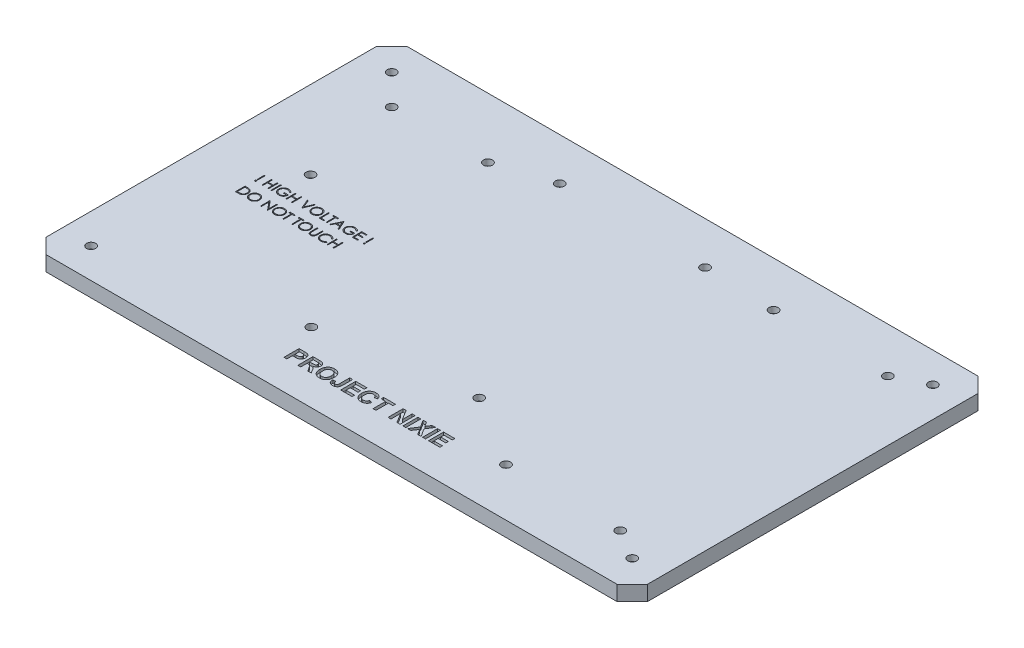
from build123d import *

# Parameters (mm, degrees)
SKETCH1_W           = 200
SKETCH1_H           = 120
BOSS_EXTRUDE1_DEPTH = 5
CHAMFER1_SIZE       = 5
SKETCH2_R           = 1.5
CUT_EXTRUDE7_DEPTH  = 144.578338607
SKETCH10_R          = 3.075
CUT_EXTRUDE8_DEPTH  = 3
SKETCH11_R          = 1.5
CUT_EXTRUDE9_DEPTH  = 144.578338607
SKETCH12_R          = 3.075
CUT_EXTRUDE10_DEPTH = 3
SKETCH7_R           = 1.5
CUT_EXTRUDE11_DEPTH = 144.578338607
SKETCH13_R          = 3.075
CUT_EXTRUDE12_DEPTH = 3
SKETCH14_R          = 1.5
CUT_EXTRUDE13_DEPTH = 144.578338607
SKETCH16_R          = 3
CUT_EXTRUDE14_DEPTH = 3
SKETCH17_W          = 0.961538461
SKETCH17_H          = 5
SKETCH17_W_2        = 0.961538462
CUT_EXTRUDE15_DEPTH = 1
SKETCH21_W          = 0.284935897
SKETCH21_H          = 2.442307692
SKETCH21_W_2        = 0.284935898
SKETCH21_H_2        = 3.175
CUT_EXTRUDE16_DEPTH = 1


with BuildPart() as part:
    # Sketch1 → Boss-Extrude1 (new body)
    with BuildSketch(Plane(origin=(0, 0, 0), x_dir=(1, 0, 0), z_dir=(0, 1, 0))):
        with Locations((-11.182432432, 30.709459459)):
            Rectangle(SKETCH1_W, SKETCH1_H)
    extrude(amount=BOSS_EXTRUDE1_DEPTH)

    # Chamfer1
    chamfer1_edges = [part.edges().sort_by_distance(p)[0] for p in [
        (-111.182432432, 2.5, -90.709459459),
        (88.817567568, 2.5, -90.709459459),
        (88.817567568, 2.5, 29.290540541),
        (-111.182432432, 2.5, 29.290540541),
    ]]
    chamfer(chamfer1_edges, length=CHAMFER1_SIZE)

    # Sketch2 → Cut-Extrude7 (cut, through all)
    with BuildSketch(Plane(origin=(0, 5, 0), x_dir=(1, 0, 0), z_dir=(0, 1, 0))):
        with Locations(Location((-41.182432432, 76.589459459, 0), (0, 0, 270))):
            Circle(SKETCH2_R)
        with Locations(Location((7.157567568, 76.589459459, 0), (0, 0, 270))):
            Circle(SKETCH2_R)
        with Locations(Location((7.157567568, 1.459459459, 0), (0, 0, 270))):
            Circle(SKETCH2_R)
        with Locations(Location((-41.182432432, -6.040540541, 0), (0, 0, 270))):
            Circle(SKETCH2_R)
    extrude(amount=-CUT_EXTRUDE7_DEPTH, mode=Mode.SUBTRACT)

    # Sketch10 → Cut-Extrude8 (cut)
    with BuildSketch(Plane.XZ):
        with Locations(Location((-41.182432432, 6.040540541, 0), (0, 0, 270))):
            Circle(SKETCH10_R)
        with Locations(Location((7.157567568, -1.459459459, 0), (0, 0, 270))):
            Circle(SKETCH10_R)
        with Locations(Location((-41.182432432, -76.589459459, 0), (0, 0, 270))):
            Circle(SKETCH10_R)
        with Locations(Location((7.157567568, -76.589459459, 0), (0, 0, 270))):
            Circle(SKETCH10_R)
    extrude(amount=-CUT_EXTRUDE8_DEPTH, mode=Mode.SUBTRACT)

    # Sketch11 → Cut-Extrude9 (cut, through all)
    with BuildSketch(Plane(origin=(0, 5, 0), x_dir=(1, 0, 0), z_dir=(0, 1, 0))):
        with Locations(Location((30.817567568, 75.709459459, 0), (0, 0, 270))):
            Circle(SKETCH11_R)
        with Locations(Location((68.817567568, 75.709459459, 0), (0, 0, 270))):
            Circle(SKETCH11_R)
        with Locations(Location((30.817567568, -13.290540541, 0), (0, 0, 270))):
            Circle(SKETCH11_R)
        with Locations(Location((68.817567568, -13.290540541, 0), (0, 0, 270))):
            Circle(SKETCH11_R)
    extrude(amount=-CUT_EXTRUDE9_DEPTH, mode=Mode.SUBTRACT)

    # Sketch12 → Cut-Extrude10 (cut)
    with BuildSketch(Plane.XZ):
        with Locations(Location((30.817567568, 13.290540541, 0), (0, 0, 270))):
            Circle(SKETCH12_R)
        with Locations(Location((68.817567568, 13.290540541, 0), (0, 0, 270))):
            Circle(SKETCH12_R)
        with Locations(Location((30.817567568, -75.709459459, 0), (0, 0, 270))):
            Circle(SKETCH12_R)
        with Locations(Location((68.817567568, -75.709459459, 0), (0, 0, 270))):
            Circle(SKETCH12_R)
    extrude(amount=-CUT_EXTRUDE10_DEPTH, mode=Mode.SUBTRACT)

    # Sketch7 → Cut-Extrude11 (cut, through all)
    with BuildSketch(Plane(origin=(0, 5, 0), x_dir=(1, 0, 0), z_dir=(0, 1, 0))):
        with Locations(Location((-59.182432432, 70.709459459, 0), (0, 0, 270))):
            Circle(SKETCH7_R)
        with Locations(Location((-91.182432432, 70.709459459, 0), (0, 0, 270))):
            Circle(SKETCH7_R)
        with Locations(Location((-85.182432432, 37.709459459, 0), (0, 0, 270))):
            Circle(SKETCH7_R)
    extrude(amount=-CUT_EXTRUDE11_DEPTH, mode=Mode.SUBTRACT)

    # Sketch13 → Cut-Extrude12 (cut)
    with BuildSketch(Plane.XZ):
        with Locations(Location((-85.182432432, -37.709459459, 0), (0, 0, 270))):
            Circle(SKETCH13_R)
        with Locations(Location((-91.182432432, -70.709459459, 0), (0, 0, 270))):
            Circle(SKETCH13_R)
        with Locations(Location((-59.182432432, -70.709459459, 0), (0, 0, 270))):
            Circle(SKETCH13_R)
    extrude(amount=-CUT_EXTRUDE12_DEPTH, mode=Mode.SUBTRACT)

    # Sketch14 → Cut-Extrude13 (cut, through all)
    with BuildSketch(Plane.XZ):
        with Locations(Location((-101.182432432, 19.290540541, 0), (0, 0, 270))):
            Circle(SKETCH14_R)
        with Locations(Location((-101.182432432, -80.709459459, 0), (0, 0, 270))):
            Circle(SKETCH14_R)
        with Locations(Location((78.817567568, 19.290540541, 0), (0, 0, 270))):
            Circle(SKETCH14_R)
        with Locations(Location((78.817567568, -80.709459459, 0), (0, 0, 270))):
            Circle(SKETCH14_R)
    extrude(amount=-CUT_EXTRUDE13_DEPTH, mode=Mode.SUBTRACT)

    # Sketch16 → Cut-Extrude14 (cut)
    with BuildSketch(Plane.XZ):
        with Locations(Location((-101.182432432, 19.290540541, 0), (0, 0, 270))):
            Circle(SKETCH16_R)
        with Locations(Location((78.817567568, 19.290540541, 0), (0, 0, 270))):
            Circle(SKETCH16_R)
        with Locations(Location((-101.182432432, -80.709459459, 0), (0, 0, 270))):
            Circle(SKETCH16_R)
        with Locations(Location((78.817567568, -80.709459459, 0), (0, 0, 270))):
            Circle(SKETCH16_R)
    extrude(amount=-CUT_EXTRUDE14_DEPTH, mode=Mode.SUBTRACT)

    # Sketch17 → Cut-Extrude15 (cut)
    # profile 1 of 12: a face of its own
    with BuildSketch(Plane(origin=(0, 5, 0), x_dir=(1, 0, 0), z_dir=(0, 1, 0))):
        with BuildLine():
            Line((-37.015765766, -19.290540541), (-37.015765766, -14.290540541))
            Line((-37.015765766, -14.290540541), (-35.416206471, -14.290540541))
            add(Edge.make_bspline(
                [(-35.416206471, -14.290540541), (-35.343754851, -14.290619661), (-35.205182514, -14.290770989), (-35.007517457, -14.294975502), (-34.829549687, -14.300927453), (-34.671543336, -14.308340357), (-34.532942421, -14.319401834), (-34.414368692, -14.332210857), (-34.315075496, -14.345989967), (-34.256604674, -14.360249503), (-34.230309035, -14.366662335)],
                knots=[0, 0, 0, 0, 1.460485487, 2.793352117, 3.985295279, 5.050041172, 5.981765236, 6.787433016, 7.454681457, 8, 8, 8, 8], degree=3))
            add(Edge.make_bspline(
                [(-34.230309035, -14.366662335), (-34.19534223, -14.376632719), (-34.125941314, -14.396421595), (-34.026511444, -14.438608334), (-33.930676793, -14.487500514), (-33.839641423, -14.545771155), (-33.753095874, -14.612385748), (-33.670782894, -14.686801041), (-33.59226352, -14.769352961), (-33.518623967, -14.859878432), (-33.451178798, -14.957920977), (-33.392889227, -15.06362555), (-33.344054754, -15.176532704), (-33.302448594, -15.295793956), (-33.271751372, -15.422687981), (-33.250268897, -15.556333104), (-33.235314413, -15.696787779), (-33.23425559, -15.792903503), (-33.233714484, -15.842022912)],
                knots=[0, 0, 0, 0, 0.907145743, 1.80047177, 2.69161667, 3.591261238, 4.495029544, 5.415863088, 6.359363025, 7.337192411, 8.326890979, 9.326929023, 10.346104993, 11.395420813, 12.477187422, 13.601053412, 14.774031606, 16, 16, 16, 16], degree=3))
            add(Edge.make_bspline(
                [(-33.233714484, -15.842022912), (-33.235257715, -15.91661632), (-33.238228521, -16.060212726), (-33.271466561, -16.266075578), (-33.322162749, -16.454118023), (-33.396258891, -16.622528821), (-33.486597481, -16.771968844), (-33.586107297, -16.906688319), (-33.699732884, -17.022626664), (-33.822495308, -17.121654912), (-33.952232752, -17.202695522), (-34.082205048, -17.271781491), (-34.214165981, -17.324896992), (-34.304136652, -17.348039842), (-34.348498138, -17.359450797)],
                knots=[0, 0, 0, 0, 1.312386234, 2.526415563, 3.661883817, 4.733421185, 5.753802465, 6.732107337, 7.675884281, 8.604170108, 9.50284679, 10.365392406, 11.194030444, 12, 12, 12, 12], degree=3))
            add(Edge.make_bspline(
                [(-34.348498138, -17.359450797), (-34.38016119, -17.365473854), (-34.446903128, -17.378169739), (-34.552751848, -17.390825225), (-34.668450236, -17.404833469), (-34.794474167, -17.413970433), (-34.930671184, -17.422526816), (-35.076988402, -17.426566568), (-35.233216719, -17.431433647), (-35.340747589, -17.431521103), (-35.39617442, -17.431566182)],
                knots=[0, 0, 0, 0, 0.735353946, 1.55003838, 2.431865514, 3.394945452, 4.432993119, 5.54609699, 6.735134699, 8, 8, 8, 8], degree=3))
            Line((-35.39617442, -17.431566182), (-36.054227304, -17.431566182))
            Line((-36.054227304, -17.431566182), (-36.054227304, -19.290540541))
            Line((-36.054227304, -19.290540541), (-37.015765766, -19.290540541))
        make_face()
        with BuildLine():
            Line((-36.054227304, -15.123873874), (-36.054227304, -16.598232848))
            Line((-36.054227304, -16.598232848), (-35.477304227, -16.598232848))
            add(Edge.make_bspline(
                [(-35.477304227, -16.598232848), (-35.427553597, -16.598168425), (-35.332374382, -16.598045176), (-35.195813322, -16.593621258), (-35.072198121, -16.588221046), (-34.96127049, -16.57928259), (-34.863700016, -16.567501918), (-34.778833295, -16.553410751), (-34.706571416, -16.538289456), (-34.628430032, -16.513231048), (-34.544881269, -16.472688829), (-34.455661008, -16.414419477), (-34.377281115, -16.344751593), (-34.312058655, -16.262929077), (-34.25996035, -16.172019521), (-34.222657925, -16.072954597), (-34.198571785, -15.967376155), (-34.196371735, -15.894239232), (-34.195252945, -15.857046951)],
                knots=[0, 0, 0, 0, 1.411705958, 2.700771114, 3.876961699, 4.922619712, 5.858038221, 6.66485904, 7.363650596, 7.950905807, 8.989198271, 9.987739806, 10.967313358, 11.951275539, 12.944273208, 13.927870418, 14.946261014, 16, 16, 16, 16], degree=3))
            add(Edge.make_bspline(
                [(-34.195252945, -15.857046951), (-34.196827519, -15.811747332), (-34.199880411, -15.723917345), (-34.233545284, -15.598832785), (-34.285486336, -15.485317031), (-34.359747295, -15.386902069), (-34.449452784, -15.30414318), (-34.550278011, -15.235284841), (-34.664376143, -15.187097252), (-34.745127038, -15.16842634), (-34.786198458, -15.158929964)],
                knots=[0, 0, 0, 0, 1.085904563, 2.105425768, 3.088705091, 4.068969419, 5.045188284, 6.010769642, 6.988240112, 8, 8, 8, 8], degree=3))
            add(Edge.make_bspline(
                [(-34.786198458, -15.158929964), (-34.803872429, -15.156103156), (-34.843103164, -15.14982852), (-34.908312629, -15.143280157), (-34.985455436, -15.137324427), (-35.074624575, -15.132434595), (-35.175466599, -15.128611879), (-35.288314133, -15.125262236), (-35.412869969, -15.124993137), (-35.500008034, -15.124257298), (-35.545413202, -15.123873874)],
                knots=[0, 0, 0, 0, 0.564603001, 1.253243608, 2.066786758, 3.005752288, 4.070476343, 5.250658742, 6.567396469, 8, 8, 8, 8], degree=3))
            Line((-35.545413202, -15.123873874), (-36.054227304, -15.123873874))
        make_face(mode=Mode.SUBTRACT)
    # profile 2 of 12: a face of its own
    with BuildSketch(Plane(origin=(0, 5, 0), x_dir=(1, 0, 0), z_dir=(0, 1, 0))):
        with BuildLine():
            Line((-32.40038115, -19.290540541), (-32.40038115, -14.290540541))
            Line((-32.40038115, -14.290540541), (-30.302023779, -14.290540541))
            add(Edge.make_bspline(
                [(-30.302023779, -14.290540541), (-30.238252624, -14.290933561), (-30.115353938, -14.291690983), (-29.937618461, -14.297214254), (-29.773706455, -14.308785828), (-29.622890803, -14.321890732), (-29.485895887, -14.340957522), (-29.362180051, -14.363799348), (-29.251951581, -14.390269876), (-29.153602177, -14.421972626), (-29.0639275, -14.458257524), (-28.980391139, -14.501446762), (-28.902074587, -14.552048262), (-28.827774977, -14.60831793), (-28.757177682, -14.670342227), (-28.692218105, -14.739762621), (-28.631764476, -14.815545421), (-28.575865575, -14.897060109), (-28.526622143, -14.983946749), (-28.481626574, -15.073414957), (-28.444998484, -15.166416809), (-28.414744014, -15.262514197), (-28.390576277, -15.36149848), (-28.373801825, -15.463621314), (-28.363329716, -15.568697851), (-28.36239487, -15.639674006), (-28.361919612, -15.675756887)],
                knots=[0, 0, 0, 0, 1.675828044, 3.229627355, 4.67171229, 5.993455049, 7.206927059, 8.304770529, 9.29850117, 10.183580433, 11.017754134, 11.837875825, 12.650738409, 13.464925643, 14.285328857, 15.117007378, 15.959673368, 16.830859064, 17.711229498, 18.58228265, 19.460420693, 20.334473227, 21.228207035, 22.135446768, 23.052097822, 24, 24, 24, 24], degree=3))
            add(Edge.make_bspline(
                [(-28.361919612, -15.675756887), (-28.362801143, -15.721211217), (-28.364523899, -15.810041507), (-28.380377607, -15.940239068), (-28.403924413, -16.064633543), (-28.437490204, -16.18339727), (-28.483642482, -16.295133419), (-28.537219636, -16.401407254), (-28.601119392, -16.501858291), (-28.674907622, -16.595490712), (-28.758518266, -16.682387402), (-28.852317738, -16.760760092), (-28.955636339, -16.830915082), (-29.069099084, -16.892447815), (-29.191915926, -16.945051635), (-29.324619438, -16.989310886), (-29.466608872, -17.025332986), (-29.565376644, -17.04228246), (-29.615926022, -17.050957207)],
                knots=[0, 0, 0, 0, 1.05911256, 2.069797862, 3.05271628, 4.008392045, 4.940519534, 5.866323021, 6.779546087, 7.71056835, 8.640711998, 9.585328432, 10.554502533, 11.547017206, 12.589327225, 13.664782803, 14.804835066, 16, 16, 16, 16], degree=3))
            add(Edge.make_bspline(
                [(-29.615926022, -17.050957207), (-29.567039096, -17.083335478), (-29.471360722, -17.146704165), (-29.338982804, -17.251073186), (-29.220138844, -17.360616547), (-29.130156191, -17.458029317), (-29.061013797, -17.543693385), (-29.005342355, -17.618616004), (-28.945291781, -17.704841071), (-28.881451039, -17.802415304), (-28.811932836, -17.910475403), (-28.739322677, -18.030675394), (-28.662101093, -18.161842828), (-28.610181818, -18.253469922), (-28.583273779, -18.300957207)],
                knots=[0, 0, 0, 0, 1.285445069, 2.515791127, 3.691898215, 4.826622834, 5.420063933, 6.105349801, 6.873086501, 7.723915395, 8.66222816, 9.690593598, 10.803111229, 12, 12, 12, 12], degree=3))
            Line((-28.583273779, -18.300957207), (-27.977304227, -19.290540541))
            Line((-27.977304227, -19.290540541), (-29.101102304, -19.290540541))
            Line((-29.101102304, -19.290540541), (-29.812240125, -18.155724835))
            add(Edge.make_bspline(
                [(-29.812240125, -18.155724835), (-29.844899813, -18.110276285), (-29.907253872, -18.02350566), (-29.997265809, -17.900201785), (-30.079618743, -17.79043919), (-30.152120987, -17.692628027), (-30.218441124, -17.609541472), (-30.276565411, -17.539731616), (-30.325309931, -17.48170044), (-30.380464478, -17.424160024), (-30.444630936, -17.365024503), (-30.524063887, -17.307689251), (-30.605634158, -17.261982192), (-30.693030187, -17.227106632), (-30.794101055, -17.202789074), (-30.915604244, -17.187295699), (-31.061360098, -17.175864861), (-31.166712379, -17.175404216), (-31.223498138, -17.175155925)],
                knots=[0, 0, 0, 0, 1.465447777, 2.797841088, 3.997266218, 5.05856206, 5.985598736, 6.780315439, 7.437430484, 7.969193402, 8.866571936, 9.718200644, 10.52825214, 11.309096006, 12.174169268, 13.242355782, 14.513606761, 16, 16, 16, 16], degree=3))
            Line((-31.223498138, -17.175155925), (-31.438842689, -17.175155925))
            Line((-31.438842689, -17.175155925), (-31.438842689, -19.290540541))
            Line((-31.438842689, -19.290540541), (-32.40038115, -19.290540541))
        make_face()
        with BuildLine():
            Line((-31.438842689, -16.341822592), (-30.664603907, -16.341822592))
            add(Edge.make_bspline(
                [(-30.664603907, -16.341822592), (-30.604838735, -16.341694511), (-30.490975984, -16.341450497), (-30.329060886, -16.337916041), (-30.184416183, -16.334916143), (-30.057907465, -16.327378774), (-29.948968721, -16.31990853), (-29.858036959, -16.310199924), (-29.784346055, -16.298724664), (-29.710741228, -16.280883648), (-29.635344876, -16.249799201), (-29.55498663, -16.205525797), (-29.486306425, -16.148091186), (-29.426813505, -16.081690968), (-29.381428742, -16.003631472), (-29.345881738, -15.917390338), (-29.327858654, -15.821051211), (-29.324955669, -15.75427565), (-29.323458073, -15.7198274)],
                knots=[0, 0, 0, 0, 1.697953026, 3.23488743, 4.60134403, 5.807846676, 6.835100678, 7.703488618, 8.405232423, 8.952775585, 9.851109663, 10.713519226, 11.549115941, 12.382556273, 13.233359028, 14.101746968, 15.020727134, 16, 16, 16, 16], degree=3))
            add(Edge.make_bspline(
                [(-29.323458073, -15.7198274), (-29.325161306, -15.68128991), (-29.32844742, -15.606938037), (-29.354362178, -15.501134614), (-29.399595333, -15.407671857), (-29.461717624, -15.326395456), (-29.539702373, -15.257764491), (-29.632590832, -15.203286443), (-29.739692907, -15.162713453), (-29.81694184, -15.147729927), (-29.85731224, -15.139899515)],
                knots=[0, 0, 0, 0, 1.062977961, 2.050844577, 2.982300261, 3.90936959, 4.856017476, 5.831122378, 6.86654153, 8, 8, 8, 8], degree=3))
            add(Edge.make_bspline(
                [(-29.85731224, -15.139899515), (-29.870656717, -15.138433244), (-29.902285928, -15.134957873), (-29.958139366, -15.132725795), (-30.029555151, -15.129294848), (-30.117397702, -15.127892697), (-30.220882237, -15.125434849), (-30.340420256, -15.124983526), (-30.47563198, -15.123541581), (-30.571120423, -15.123759055), (-30.621534997, -15.123873874)],
                knots=[0, 0, 0, 0, 0.42127143, 0.998501726, 1.753681744, 2.66564073, 3.755712164, 5.002818897, 6.417592707, 8, 8, 8, 8], degree=3))
            Line((-30.621534997, -15.123873874), (-31.438842689, -15.123873874))
            Line((-31.438842689, -15.123873874), (-31.438842689, -16.341822592))
        make_face(mode=Mode.SUBTRACT)
    # profile 3 of 12: a face of its own
    with BuildSketch(Plane(origin=(0, 5, 0), x_dir=(1, 0, 0), z_dir=(0, 1, 0))):
        with BuildLine():
            add(Edge.make_bspline(
                [(-27.592688843, -16.820588617), (-27.592335013, -16.758800681), (-27.591640138, -16.63745715), (-27.579599556, -16.459441633), (-27.563729131, -16.288807114), (-27.53788417, -16.126224761), (-27.50748106, -15.970933632), (-27.469454838, -15.822979824), (-27.423646707, -15.682882205), (-27.387205976, -15.59343139), (-27.369331471, -15.549554964)],
                knots=[0, 0, 0, 0, 1.141009212, 2.240794809, 3.294380675, 4.305229195, 5.280013876, 6.216333343, 7.125095522, 8, 8, 8, 8], degree=3))
            add(Edge.make_bspline(
                [(-27.369331471, -15.549554964), (-27.340113439, -15.487179541), (-27.282021026, -15.363162333), (-27.174134285, -15.187916049), (-27.051851025, -15.022644603), (-26.916177971, -14.868214418), (-26.770578899, -14.726950352), (-26.614366939, -14.606048652), (-26.453091835, -14.50142621), (-26.338388622, -14.44880734), (-26.281591086, -14.422752079)],
                knots=[0, 0, 0, 0, 1.031372299, 2.050613973, 3.077158538, 4.108712802, 5.127684358, 6.111366908, 7.06480644, 8, 8, 8, 8], degree=3))
            add(Edge.make_bspline(
                [(-26.281591086, -14.422752079), (-26.243037132, -14.406938107), (-26.165109759, -14.374974038), (-26.044001449, -14.335081204), (-25.918297948, -14.30267008), (-25.78890846, -14.273698311), (-25.654576721, -14.253721324), (-25.51638819, -14.236971306), (-25.373586605, -14.22819233), (-25.276993803, -14.227029121), (-25.227905189, -14.226437976)],
                knots=[0, 0, 0, 0, 0.92659354, 1.872881803, 2.832850937, 3.813025581, 4.820167273, 5.851730198, 6.908245912, 8, 8, 8, 8], degree=3))
            add(Edge.make_bspline(
                [(-25.227905189, -14.226437976), (-25.140008224, -14.228641265), (-24.967992656, -14.23295313), (-24.716726216, -14.264097222), (-24.478951874, -14.316686887), (-24.255474498, -14.392698447), (-24.044367337, -14.487714546), (-23.847270568, -14.605571197), (-23.663892483, -14.74499283), (-23.494587268, -14.904067528), (-23.342115795, -15.082518062), (-23.209325809, -15.27867744), (-23.097932964, -15.491626439), (-23.006194524, -15.720777525), (-22.935700446, -15.966879176), (-22.884768539, -16.229236992), (-22.854510864, -16.508044222), (-22.850935377, -16.699318331), (-22.849099099, -16.797551758)],
                knots=[0, 0, 0, 0, 1.064641025, 2.083517118, 3.061799897, 4.009540929, 4.938075217, 5.861300345, 6.78508344, 7.723570974, 8.670267188, 9.622657076, 10.586935816, 11.576069104, 12.607749008, 13.683335114, 14.81022093, 16, 16, 16, 16], degree=3))
            add(Edge.make_bspline(
                [(-22.849099099, -16.797551758), (-22.850892964, -16.895127401), (-22.854385285, -17.085088947), (-22.885207738, -17.361708365), (-22.934028083, -17.622153585), (-23.006227837, -17.865829657), (-23.095228269, -18.094595991), (-23.207767375, -18.305727799), (-23.337776338, -18.502025603), (-23.490031253, -18.678553194), (-23.656486966, -18.838540822), (-23.839632445, -18.976332967), (-24.035294446, -19.094349307), (-24.245250611, -19.189639988), (-24.468132484, -19.264086116), (-24.704667424, -19.317079895), (-24.954976746, -19.348104139), (-25.126322087, -19.352431661), (-25.213882753, -19.354643105)],
                knots=[0, 0, 0, 0, 1.18845052, 2.313691126, 3.386664782, 4.412527756, 5.405809582, 6.372003093, 7.321919452, 8.268293321, 9.206237639, 10.129603466, 11.054616372, 11.9847576, 12.932764752, 13.912672021, 14.933336461, 16, 16, 16, 16], degree=3))
            add(Edge.make_bspline(
                [(-25.213882753, -19.354643105), (-25.302443592, -19.352426557), (-25.475782595, -19.348088138), (-25.728761698, -19.317158328), (-25.96764465, -19.264147106), (-26.192261346, -19.189439112), (-26.404143711, -19.095596013), (-26.601335518, -18.978785629), (-26.783945769, -18.840120821), (-26.951792316, -18.682016388), (-27.103953087, -18.506007791), (-27.233777454, -18.310972127), (-27.346322429, -18.10190255), (-27.435790782, -17.875632157), (-27.507592959, -17.63448898), (-27.556532599, -17.377085462), (-27.587414653, -17.104130047), (-27.590898645, -16.916829954), (-27.592688843, -16.820588617)],
                knots=[0, 0, 0, 0, 1.080878253, 2.11558926, 3.1052859, 4.062802436, 5.000434901, 5.928596448, 6.853693179, 7.793554778, 8.738606028, 9.68692032, 10.647726704, 11.63151566, 12.651483354, 13.714466703, 14.825613081, 16, 16, 16, 16], degree=3))
        make_face()
        with BuildLine():
            add(Edge.make_bspline(
                [(-26.631150381, -16.787535733), (-26.630189816, -16.856698942), (-26.628329701, -16.990632182), (-26.608517006, -17.185033037), (-26.578449648, -17.366770573), (-26.534231182, -17.535638522), (-26.478369566, -17.691759048), (-26.409927506, -17.835262743), (-26.329187847, -17.966363342), (-26.234062252, -18.082293125), (-26.131143816, -18.185796076), (-26.020052547, -18.275352232), (-25.902858795, -18.352433762), (-25.777534751, -18.413289369), (-25.646688634, -18.461584951), (-25.50930386, -18.497394357), (-25.36469732, -18.517057237), (-25.266021831, -18.519877055), (-25.215885958, -18.521309771)],
                knots=[0, 0, 0, 0, 1.313550922, 2.543666373, 3.708465049, 4.810029406, 5.85539231, 6.85404609, 7.825601258, 8.772642133, 9.696587791, 10.59409323, 11.479048685, 12.35559886, 13.234601248, 14.125357077, 15.047515647, 16, 16, 16, 16], degree=3))
            add(Edge.make_bspline(
                [(-25.215885958, -18.521309771), (-25.165743331, -18.519906084), (-25.067054549, -18.5171434), (-24.922625686, -18.497078485), (-24.784968652, -18.462803947), (-24.654642348, -18.414755852), (-24.531052764, -18.352933932), (-24.414307548, -18.277580408), (-24.305079648, -18.18761681), (-24.202273238, -18.085617499), (-24.109715311, -17.968917722), (-24.029663084, -17.837839747), (-23.961254746, -17.693465698), (-23.905387247, -17.535741564), (-23.862257007, -17.364370589), (-23.833416771, -17.179262101), (-23.813443862, -16.980945381), (-23.811591333, -16.844012837), (-23.810637561, -16.773513297)],
                knots=[0, 0, 0, 0, 0.949153107, 1.868086493, 2.754172764, 3.630100905, 4.492260106, 5.365378617, 6.254840125, 7.166615376, 8.102436631, 9.067266169, 10.06813181, 11.121736829, 12.23011542, 13.408501285, 14.665770308, 16, 16, 16, 16], degree=3))
            add(Edge.make_bspline(
                [(-23.810637561, -16.773513297), (-23.811714858, -16.703694468), (-23.813801148, -16.568483671), (-23.831970576, -16.372670513), (-23.861728741, -16.190496404), (-23.903095879, -16.022008535), (-23.957765152, -15.867179759), (-24.023061199, -15.725586679), (-24.102013395, -15.597969041), (-24.192561889, -15.484392925), (-24.292757968, -15.384424045), (-24.400899334, -15.296905573), (-24.517600406, -15.224084884), (-24.641722204, -15.162816154), (-24.774556962, -15.117361107), (-24.91475477, -15.084206578), (-25.062712377, -15.063789969), (-25.164070732, -15.061130733), (-25.215885958, -15.05977131)],
                knots=[0, 0, 0, 0, 1.332337092, 2.580197383, 3.749299508, 4.852775005, 5.886662144, 6.878700295, 7.822989687, 8.743523536, 9.644687758, 10.519443927, 11.392806431, 12.264866173, 13.155606721, 14.065961015, 15.011303331, 16, 16, 16, 16], degree=3))
            add(Edge.make_bspline(
                [(-25.215885958, -15.05977131), (-25.267707734, -15.061109822), (-25.3690789, -15.063728154), (-25.517267139, -15.084482789), (-25.657906615, -15.116649397), (-25.790722599, -15.164699933), (-25.915925536, -15.225380289), (-26.033052336, -15.300636026), (-26.143025921, -15.388005971), (-26.244119727, -15.489490609), (-26.336135392, -15.604061297), (-26.415125609, -15.733238292), (-26.482482123, -15.87561082), (-26.537744238, -16.031600317), (-26.578710554, -16.201635901), (-26.610196578, -16.384574828), (-26.627877961, -16.581524353), (-26.63003613, -16.717389361), (-26.631150381, -16.787535733)],
                knots=[0, 0, 0, 0, 0.981996942, 1.920933313, 2.83127778, 3.712125466, 4.592427284, 5.463259035, 6.34592384, 7.249932058, 8.173122297, 9.125107726, 10.113123258, 11.154048744, 12.256187849, 13.424658091, 14.670364834, 16, 16, 16, 16], degree=3))
        make_face(mode=Mode.SUBTRACT)
    # profile 4 of 12: a face of its own
    with BuildSketch(Plane(origin=(0, 5, 0), x_dir=(1, 0, 0), z_dir=(0, 1, 0))):
        with BuildLine():
            Line((-20.156791407, -14.290540541), (-19.195252945, -14.290540541))
            Line((-19.195252945, -14.290540541), (-19.195252945, -17.44258381))
            add(Edge.make_bspline(
                [(-19.195252945, -17.44258381), (-19.195682633, -17.492668644), (-19.196516445, -17.589858627), (-19.201639825, -17.731122899), (-19.20926255, -17.863433567), (-19.220988924, -17.986771641), (-19.237512051, -18.100870495), (-19.255023118, -18.206640261), (-19.276283668, -18.303546365), (-19.295335407, -18.364171848), (-19.304427625, -18.393104643)],
                knots=[0, 0, 0, 0, 1.251619961, 2.428777588, 3.532126049, 4.56323557, 5.523704531, 6.412540087, 7.242403515, 8, 8, 8, 8], degree=3))
            add(Edge.make_bspline(
                [(-19.304427625, -18.393104643), (-19.3171341, -18.428757729), (-19.342280949, -18.499317245), (-19.391158386, -18.599967379), (-19.447364913, -18.695255586), (-19.510742347, -18.785594807), (-19.580692056, -18.871347246), (-19.659586606, -18.950252668), (-19.744650702, -19.025063357), (-19.8382771, -19.092679369), (-19.938109462, -19.155723738), (-20.046991639, -19.208249777), (-20.162781328, -19.253685496), (-20.286450322, -19.290590195), (-20.41803448, -19.319465889), (-20.5571967, -19.340483612), (-20.70412237, -19.352426317), (-20.804472747, -19.353891888), (-20.855909997, -19.354643105)],
                knots=[0, 0, 0, 0, 0.925533072, 1.831683394, 2.73255258, 3.630007683, 4.529542467, 5.436465751, 6.357118906, 7.298274949, 8.259461937, 9.242242071, 10.251058183, 11.300341426, 12.396409345, 13.544807631, 14.74152597, 16, 16, 16, 16], degree=3))
            add(Edge.make_bspline(
                [(-20.855909997, -19.354643105), (-20.916053542, -19.353189466), (-21.032978021, -19.350363461), (-21.203008608, -19.331601368), (-21.362459746, -19.298785677), (-21.510851641, -19.251386386), (-21.649700609, -19.192464517), (-21.777327251, -19.118967573), (-21.894409856, -19.032370104), (-22.000187062, -18.932406691), (-22.094711161, -18.820088211), (-22.176302358, -18.694429211), (-22.245551552, -18.556743801), (-22.301354587, -18.406409098), (-22.345411206, -18.244144838), (-22.377188624, -18.06960937), (-22.396150584, -17.882703312), (-22.398943987, -17.75412698), (-22.40038115, -17.687976438)],
                knots=[0, 0, 0, 0, 1.114068574, 2.165849827, 3.164101702, 4.124467949, 5.046988974, 5.952942428, 6.846011651, 7.738523925, 8.642829306, 9.558838605, 10.50752403, 11.491963144, 12.524197802, 13.618364352, 14.774685164, 16, 16, 16, 16], degree=3))
            Line((-22.40038115, -17.687976438), (-21.438842689, -17.623873874))
            add(Edge.make_bspline(
                [(-21.438842689, -17.623873874), (-21.437115743, -17.659282733), (-21.433804227, -17.727181205), (-21.424609283, -17.825059897), (-21.412982093, -17.915021884), (-21.397768155, -17.99679715), (-21.381384423, -18.071076675), (-21.360101699, -18.136398659), (-21.337727257, -18.195060019), (-21.318074967, -18.229381591), (-21.308634356, -18.245869066)],
                knots=[0, 0, 0, 0, 1.326609226, 2.543847584, 3.678365909, 4.719972403, 5.656527627, 6.521948534, 7.28997025, 8, 8, 8, 8], degree=3))
            add(Edge.make_bspline(
                [(-21.308634356, -18.245869066), (-21.294181739, -18.267675828), (-21.265737189, -18.310594252), (-21.21384679, -18.366521474), (-21.15813728, -18.415416177), (-21.095561009, -18.453857219), (-21.027859793, -18.484089943), (-20.954525406, -18.506058168), (-20.875760039, -18.519378664), (-20.821574873, -18.520655517), (-20.793810638, -18.521309771)],
                knots=[0, 0, 0, 0, 1.023658308, 2.014687051, 2.979722519, 3.920049697, 4.880550909, 5.878122304, 6.912759386, 8, 8, 8, 8], degree=3))
            add(Edge.make_bspline(
                [(-20.793810638, -18.521309771), (-20.765738892, -18.520786664), (-20.711776043, -18.519781084), (-20.634009314, -18.510636956), (-20.56250666, -18.495819949), (-20.497229135, -18.47499241), (-20.437955617, -18.447955202), (-20.385999961, -18.413365773), (-20.33912334, -18.374444836), (-20.298629339, -18.32762565), (-20.264127657, -18.271212283), (-20.235320321, -18.202549778), (-20.210538151, -18.121355703), (-20.19138523, -18.027012793), (-20.175082316, -17.920424231), (-20.164855836, -17.800647585), (-20.157504969, -17.668036861), (-20.157035909, -17.575141292), (-20.156791407, -17.526718425)],
                knots=[0, 0, 0, 0, 0.980314827, 1.884477813, 2.730827652, 3.527503874, 4.27366112, 4.998269146, 5.70163477, 6.396145331, 7.150281155, 8.001758491, 8.990432449, 10.111292654, 11.361572691, 12.75538406, 14.308707205, 16, 16, 16, 16], degree=3))
            Line((-20.156791407, -17.526718425), (-20.156791407, -14.290540541))
        make_face()
    # profile 5 of 12: a face of its own
    with BuildSketch(Plane(origin=(0, 5, 0), x_dir=(1, 0, 0), z_dir=(0, 1, 0))):
        Polygon((-18.16961192, -19.290540541), (-18.16961192, -14.290540541), (-14.451663202, -14.290540541), (-14.451663202, -15.123873874), (-17.208073458, -15.123873874), (-17.208073458, -16.213617464), (-14.643970894, -16.213617464), (-14.643970894, -17.046950797), (-17.208073458, -17.046950797), (-17.208073458, -18.457207207), (-14.387560638, -18.457207207), (-14.387560638, -19.290540541), align=None)
    # profile 6 of 12: a face of its own
    with BuildSketch(Plane(origin=(0, 5, 0), x_dir=(1, 0, 0), z_dir=(0, 1, 0))):
        with BuildLine():
            Line((-10.349099099, -17.431566182), (-9.387560638, -17.752079002))
            add(Edge.make_bspline(
                [(-9.387560638, -17.752079002), (-9.407102059, -17.815124657), (-9.445370308, -17.938587881), (-9.51563723, -18.115539998), (-9.595986365, -18.279529592), (-9.683528182, -18.432476053), (-9.783706732, -18.570428277), (-9.890913488, -18.697953781), (-10.008336136, -18.812366634), (-10.135395279, -18.913911149), (-10.270867902, -19.003709174), (-10.416327664, -19.079623568), (-10.569603784, -19.145006669), (-10.732250568, -19.197980766), (-10.903188583, -19.240404977), (-11.083219882, -19.268426399), (-11.271502296, -19.287425848), (-11.400064233, -19.289485851), (-11.465885958, -19.290540541)],
                knots=[0, 0, 0, 0, 1.126640671, 2.206316847, 3.246446654, 4.24268115, 5.210795778, 6.153057602, 7.084219323, 8.004711971, 8.926421631, 9.854560063, 10.802134612, 11.768317461, 12.772025444, 13.805668576, 14.876536225, 16, 16, 16, 16], degree=3))
            add(Edge.make_bspline(
                [(-11.465885958, -19.290540541), (-11.547129428, -19.288860602), (-11.706937762, -19.285556112), (-11.940642314, -19.25229186), (-12.163352185, -19.200391695), (-12.375385975, -19.128536819), (-12.575328389, -19.033365219), (-12.765003582, -18.91879095), (-12.943031167, -18.782487969), (-13.108786593, -18.626753507), (-13.259379406, -18.452776427), (-13.38960323, -18.261496851), (-13.500874985, -18.055609445), (-13.590810555, -17.834132513), (-13.661134101, -17.597293474), (-13.710395892, -17.345419795), (-13.741220787, -17.078432135), (-13.744732643, -16.895462009), (-13.746534997, -16.801558169)],
                knots=[0, 0, 0, 0, 1.025049111, 2.016302254, 2.973197159, 3.90886983, 4.83646737, 5.763135642, 6.70136783, 7.661478232, 8.629732022, 9.600038443, 10.576877021, 11.5787097, 12.612181225, 13.690866959, 14.814907849, 16, 16, 16, 16], degree=3))
            add(Edge.make_bspline(
                [(-13.746534997, -16.801558169), (-13.744740767, -16.702647631), (-13.741240554, -16.509691219), (-13.710357911, -16.229149116), (-13.662414448, -15.964754538), (-13.591972045, -15.718146837), (-13.503358093, -15.487590474), (-13.391951242, -15.275374164), (-13.263026396, -15.078668482), (-13.113117047, -14.901078804), (-12.94660621, -14.743403184), (-12.768169254, -14.603975308), (-12.576141522, -14.487005317), (-12.371573832, -14.391353379), (-12.154191824, -14.317333201), (-11.924423247, -14.264032864), (-11.682080108, -14.23300864), (-11.516388902, -14.228658162), (-11.431831471, -14.226437976)],
                knots=[0, 0, 0, 0, 1.212648312, 2.365655595, 3.457000981, 4.504219827, 5.506356588, 6.480637568, 7.437950897, 8.385265166, 9.323599949, 10.245787653, 11.157260172, 12.074946661, 13.00980897, 13.968233668, 14.963125779, 16, 16, 16, 16], degree=3))
            add(Edge.make_bspline(
                [(-11.431831471, -14.226437976), (-11.357984199, -14.228298736), (-11.213196795, -14.231947003), (-11.001170345, -14.256733464), (-10.800228606, -14.300232048), (-10.609285424, -14.358945464), (-10.429427751, -14.436431554), (-10.260333373, -14.531118758), (-10.101421072, -14.642506083), (-10.00567314, -14.729512776), (-9.957472497, -14.773312976)],
                knots=[0, 0, 0, 0, 1.098510076, 2.153775193, 3.169777012, 4.153122333, 5.120892526, 6.076995459, 7.031936742, 8, 8, 8, 8], degree=3))
            add(Edge.make_bspline(
                [(-9.957472497, -14.773312976), (-9.929536037, -14.801183488), (-9.873006909, -14.857579171), (-9.797524658, -14.952791062), (-9.725958107, -15.055286678), (-9.659443159, -15.166814465), (-9.60008206, -15.288217239), (-9.545018301, -15.417630638), (-9.494323164, -15.555553508), (-9.466130838, -15.651539304), (-9.451663202, -15.700796951)],
                knots=[0, 0, 0, 0, 0.885292881, 1.791380647, 2.722937556, 3.69093542, 4.703306561, 5.754477758, 6.847650944, 8, 8, 8, 8], degree=3))
            Line((-9.451663202, -15.700796951), (-10.413201663, -15.893104643))
            add(Edge.make_bspline(
                [(-10.413201663, -15.893104643), (-10.421374345, -15.861566126), (-10.437472383, -15.799443521), (-10.470044574, -15.71017675), (-10.507407445, -15.625470557), (-10.553715302, -15.547399692), (-10.60290622, -15.472491002), (-10.661145492, -15.404070666), (-10.724713751, -15.340345536), (-10.794068936, -15.281976925), (-10.868384231, -15.230144261), (-10.946228805, -15.183549924), (-11.029017514, -15.145514386), (-11.115649064, -15.114743724), (-11.20577841, -15.088944843), (-11.300207978, -15.073007672), (-11.398126731, -15.060773075), (-11.464842246, -15.060110126), (-11.498938843, -15.05977131)],
                knots=[0, 0, 0, 0, 1.051226935, 2.070641259, 3.064374968, 4.034983734, 4.997599858, 5.953980297, 6.92954377, 7.901109626, 8.875958313, 9.851998019, 10.826131395, 11.811470594, 12.818270757, 13.847890818, 14.900111925, 16, 16, 16, 16], degree=3))
            add(Edge.make_bspline(
                [(-11.498938843, -15.05977131), (-11.545764195, -15.060716968), (-11.637153273, -15.062562611), (-11.770732411, -15.08314028), (-11.898048512, -15.111858545), (-12.018588117, -15.155711188), (-12.131604755, -15.211798355), (-12.238382868, -15.279978579), (-12.3383364, -15.359959826), (-12.431499134, -15.452689612), (-12.515100024, -15.559844536), (-12.58859714, -15.681645835), (-12.649569586, -15.819476347), (-12.699069516, -15.971983522), (-12.7380316, -16.139530023), (-12.765853595, -16.322330738), (-12.781239995, -16.52051072), (-12.783717335, -16.657635412), (-12.784996535, -16.728441182)],
                knots=[0, 0, 0, 0, 0.938194206, 1.831074359, 2.704771284, 3.551924377, 4.396294915, 5.230222094, 6.087631332, 6.958733431, 7.860107878, 8.806247581, 9.804197948, 10.875520245, 12.017191412, 13.250061517, 14.580040491, 16, 16, 16, 16], degree=3))
            add(Edge.make_bspline(
                [(-12.784996535, -16.728441182), (-12.783729931, -16.803585678), (-12.781289379, -16.948377548), (-12.765906244, -17.157226429), (-12.73790634, -17.349312149), (-12.699462061, -17.524975593), (-12.649712683, -17.684109165), (-12.588843348, -17.826437486), (-12.516481324, -17.952127241), (-12.432739193, -18.061094734), (-12.339734098, -18.154697474), (-12.239985012, -18.235174519), (-12.134080435, -18.303982075), (-12.02138308, -18.360592496), (-11.901464306, -18.40341765), (-11.775309671, -18.434475202), (-11.64245629, -18.454218981), (-11.551426813, -18.456197172), (-11.504948458, -18.457207207)],
                knots=[0, 0, 0, 0, 1.475208372, 2.842499301, 4.107722225, 5.282836115, 6.369007568, 7.375918121, 8.315702116, 9.208439171, 10.065831443, 10.90006451, 11.71996243, 12.54067204, 13.369972975, 14.214060185, 15.088124569, 16, 16, 16, 16], degree=3))
            add(Edge.make_bspline(
                [(-11.504948458, -18.457207207), (-11.47053758, -18.45634871), (-11.402873696, -18.454660603), (-11.30286126, -18.443946318), (-11.206869718, -18.423499648), (-11.114429223, -18.396462629), (-11.025180612, -18.362539145), (-10.940485219, -18.319022137), (-10.8586767, -18.269005799), (-10.781452517, -18.210390483), (-10.707778598, -18.1445836), (-10.640583612, -18.068527244), (-10.578254684, -17.984048878), (-10.521582551, -17.890583929), (-10.468673615, -17.788932426), (-10.423658424, -17.677510583), (-10.381722738, -17.558119028), (-10.360163583, -17.474487266), (-10.349099099, -17.431566182)],
                knots=[0, 0, 0, 0, 0.980177776, 1.927374078, 2.859849964, 3.771585772, 4.668674471, 5.574490016, 6.479656464, 7.396337719, 8.332153134, 9.288470092, 10.28125149, 11.318486971, 12.398724812, 13.541284404, 14.738150009, 16, 16, 16, 16], degree=3))
        make_face()
    # profile 7 of 12: a face of its own
    with BuildSketch(Plane(origin=(0, 5, 0), x_dir=(1, 0, 0), z_dir=(0, 1, 0))):
        Polygon((-7.40038115, -19.290540541), (-7.40038115, -15.123873874), (-8.874740125, -15.123873874), (-8.874740125, -14.290540541), (-4.964483714, -14.290540541), (-4.964483714, -15.123873874), (-6.438842689, -15.123873874), (-6.438842689, -19.290540541), align=None)
    # profile 8 of 12: a face of its own
    with BuildSketch(Plane(origin=(0, 5, 0), x_dir=(1, 0, 0), z_dir=(0, 1, 0))):
        Polygon((-2.40038115, -19.290540541), (-2.40038115, -14.290540541), (-1.395773779, -14.290540541), (0.612439362, -17.575796951), (0.612439362, -14.290540541), (1.573977824, -14.290540541), (1.573977824, -19.290540541), (0.539322375, -19.290540541), (-1.438842689, -16.055364258), (-1.438842689, -19.290540541), align=None)
    # profile 9 of 12: a face of its own
    with BuildSketch(Plane(origin=(0, 5, 0), x_dir=(1, 0, 0), z_dir=(0, 1, 0))):
        with Locations((3.016285516, -16.790540541)):
            Rectangle(SKETCH17_W, SKETCH17_H)
    # profile 10 of 12: a face of its own
    with BuildSketch(Plane(origin=(0, 5, 0), x_dir=(1, 0, 0), z_dir=(0, 1, 0))):
        Polygon((4.041926542, -19.290540541), (5.755668529, -16.642303361), (4.234234234, -14.290540541), (5.358032311, -14.290540541), (6.317567568, -15.773913938), (7.277102824, -14.290540541), (8.400900901, -14.290540541), (6.879466606, -16.642303361), (8.593208593, -19.290540541), (7.469410516, -19.290540541), (6.317567568, -17.510692784), (5.165724619, -19.290540541), align=None)
    # profile 11 of 12: a face of its own
    with BuildSketch(Plane(origin=(0, 5, 0), x_dir=(1, 0, 0), z_dir=(0, 1, 0))):
        with Locations((9.554747055, -16.790540541)):
            Rectangle(SKETCH17_W_2, SKETCH17_H)
    # profile 12 of 12: a face of its own
    with BuildSketch(Plane(origin=(0, 5, 0), x_dir=(1, 0, 0), z_dir=(0, 1, 0))):
        Polygon((11.061157311, -19.290540541), (11.061157311, -14.290540541), (14.779106029, -14.290540541), (14.779106029, -15.123873874), (12.022695773, -15.123873874), (12.022695773, -16.213617464), (14.586798337, -16.213617464), (14.586798337, -17.046950797), (12.022695773, -17.046950797), (12.022695773, -18.457207207), (14.843208593, -18.457207207), (14.843208593, -19.290540541), align=None)
    extrude(amount=-CUT_EXTRUDE15_DEPTH, mode=Mode.SUBTRACT)

    # Sketch21 → Cut-Extrude16 (cut)
    # profile 1 of 25: a face of its own
    with BuildSketch(Plane(origin=(0, 5, 0), x_dir=(1, 0, 0), z_dir=(0, 1, 0))):
        with Locations((-92.578794363, 28.680896468)):
            Rectangle(SKETCH21_W, SKETCH21_H)
    # profile 2 of 25: a face of its own
    with BuildSketch(Plane(origin=(0, 5, 0), x_dir=(1, 0, 0), z_dir=(0, 1, 0))):
        with BuildLine():
            add(Edge.make_bspline(
                [(-92.578794362, 27.134101596), (-92.56384688, 27.133053706), (-92.5343409, 27.130985196), (-92.491658271, 27.116414448), (-92.452938305, 27.091523745), (-92.419015269, 27.057619668), (-92.390542054, 27.01745665), (-92.370039602, 26.9718695), (-92.356565514, 26.922228473), (-92.355476272, 26.887418432), (-92.354916157, 26.869518263)],
                knots=[0, 0, 0, 0, 0.932051743, 1.839848197, 2.779380411, 3.780329255, 4.815317283, 5.833513928, 6.885940208, 8, 8, 8, 8], degree=3))
            add(Edge.make_bspline(
                [(-92.354916157, 26.869518263), (-92.355511609, 26.852047663), (-92.356683219, 26.817672576), (-92.370008921, 26.768418877), (-92.39072782, 26.722767893), (-92.418800011, 26.682126857), (-92.452940546, 26.648102874), (-92.491785904, 26.623431217), (-92.534205913, 26.60786511), (-92.563824859, 26.605918668), (-92.578794362, 26.60493493)],
                knots=[0, 0, 0, 0, 1.089197406, 2.143100788, 3.162726492, 4.210031689, 5.212385385, 6.153236251, 7.066640104, 8, 8, 8, 8], degree=3))
            add(Edge.make_bspline(
                [(-92.578794362, 26.60493493), (-92.593763866, 26.605918668), (-92.623382812, 26.60786511), (-92.665802821, 26.623431217), (-92.704648179, 26.648102874), (-92.738788714, 26.682126857), (-92.766860904, 26.722767893), (-92.787579804, 26.768418877), (-92.800905506, 26.817672576), (-92.802077115, 26.852047663), (-92.802672568, 26.869518263)],
                knots=[0, 0, 0, 0, 0.933359896, 1.846763749, 2.787614615, 3.789968311, 4.837273508, 5.856899212, 6.910802594, 8, 8, 8, 8], degree=3))
            add(Edge.make_bspline(
                [(-92.802672568, 26.869518263), (-92.802112453, 26.887418432), (-92.801023211, 26.922228473), (-92.787549123, 26.9718695), (-92.767046671, 27.01745665), (-92.738573456, 27.057619668), (-92.70465042, 27.091523745), (-92.665930454, 27.116414448), (-92.623247825, 27.130985196), (-92.593741845, 27.133053706), (-92.578794362, 27.134101596)],
                knots=[0, 0, 0, 0, 1.114059792, 2.166486072, 3.184682717, 4.219670745, 5.220619589, 6.160151803, 7.067948257, 8, 8, 8, 8], degree=3))
        make_face()
    # profile 3 of 25: a face of its own
    with BuildSketch(Plane(origin=(0, 5, 0), x_dir=(1, 0, 0), z_dir=(0, 1, 0))):
        Polygon((-90.319659747, 29.820640058), (-90.03472385, 29.820640058), (-90.03472385, 28.518075955), (-88.406518721, 28.518075955), (-88.406518721, 29.820640058), (-88.121582824, 29.820640058), (-88.121582824, 26.645640058), (-88.406518721, 26.645640058), (-88.406518721, 28.19243493), (-90.03472385, 28.19243493), (-90.03472385, 26.645640058), (-90.319659747, 26.645640058), align=None)
    # profile 4 of 25: a face of its own
    with BuildSketch(Plane(origin=(0, 5, 0), x_dir=(1, 0, 0), z_dir=(0, 1, 0))):
        with Locations((-87.165012311, 28.233140058)):
            Rectangle(SKETCH21_W_2, SKETCH21_H_2)
    # profile 5 of 25: a face of its own
    with BuildSketch(Plane(origin=(0, 5, 0), x_dir=(1, 0, 0), z_dir=(0, 1, 0))):
        with BuildLine():
            Line((-83.236967439, 29.278753039), (-83.481198209, 29.047242622))
            add(Edge.make_bspline(
                [(-83.481198209, 29.047242622), (-83.5253932, 29.088817762), (-83.612729328, 29.170976659), (-83.755114691, 29.277575919), (-83.903671702, 29.368894453), (-84.057625181, 29.44319511), (-84.213162583, 29.5024794), (-84.368219402, 29.54468707), (-84.521205145, 29.5716043), (-84.622956836, 29.574823178), (-84.673095244, 29.576409289)],
                knots=[0, 0, 0, 0, 1.08915593, 2.152340314, 3.188132944, 4.216796309, 5.218260357, 6.173443236, 7.099959455, 8, 8, 8, 8], degree=3))
            add(Edge.make_bspline(
                [(-84.673095244, 29.576409289), (-84.703860722, 29.576034089), (-84.765311886, 29.575284663), (-84.856590363, 29.565719553), (-84.946911527, 29.551962855), (-85.036104874, 29.532058438), (-85.124343827, 29.506831648), (-85.211321493, 29.475276264), (-85.297200122, 29.438486863), (-85.381170781, 29.395975905), (-85.462578238, 29.34927633), (-85.539464796, 29.297525154), (-85.612320522, 29.242381037), (-85.679776051, 29.182463363), (-85.742219399, 29.118314878), (-85.801136851, 29.051128879), (-85.854456255, 28.979069788), (-85.902617526, 28.903463399), (-85.94558128, 28.825637627), (-85.983507701, 28.746341558), (-86.015345774, 28.665838204), (-86.040536637, 28.584026548), (-86.061319873, 28.501539513), (-86.075940845, 28.417805945), (-86.0841838, 28.332736188), (-86.085609629, 28.275770103), (-86.086326414, 28.247132446)],
                knots=[0, 0, 0, 0, 1.02818874, 2.053710826, 3.065248034, 4.081641283, 5.106893873, 6.131558223, 7.173050175, 8.228653731, 9.27666206, 10.308777013, 11.325269123, 12.329503258, 13.32196095, 14.316845687, 15.314881793, 16.315733098, 17.311955233, 18.285320748, 19.252783886, 20.203351036, 21.145449891, 22.095197417, 23.042428769, 24, 24, 24, 24], degree=3))
            add(Edge.make_bspline(
                [(-86.086326414, 28.247132446), (-86.085640869, 28.217858205), (-86.084271652, 28.15938966), (-86.075508363, 28.072127894), (-86.059244887, 27.986162136), (-86.037502751, 27.901209901), (-86.010305869, 27.817125698), (-85.976403522, 27.734274064), (-85.936248298, 27.652658066), (-85.889769426, 27.573013085), (-85.838800513, 27.495431485), (-85.781702147, 27.422352491), (-85.721050046, 27.352802957), (-85.65463458, 27.288327085), (-85.584585423, 27.227200265), (-85.508809716, 27.171106613), (-85.428797484, 27.118965654), (-85.344426656, 27.071434525), (-85.256612703, 27.028972496), (-85.166572649, 26.991213676), (-85.074018845, 26.96011742), (-84.97943769, 26.934773569), (-84.882941937, 26.913999728), (-84.784041773, 26.900635264), (-84.683464387, 26.890937153), (-84.615665771, 26.890228066), (-84.581508705, 26.889870827)],
                knots=[0, 0, 0, 0, 0.93586088, 1.869166235, 2.799637598, 3.729985548, 4.670839027, 5.622275134, 6.589130586, 7.576015415, 8.568469353, 9.55398029, 10.53834874, 11.515998671, 12.510579167, 13.508179873, 14.527009472, 15.561807829, 16.601455013, 17.643573243, 18.680854198, 19.719860599, 20.772568776, 21.833555941, 22.908541556, 24, 24, 24, 24], degree=3))
            add(Edge.make_bspline(
                [(-84.581508705, 26.889870827), (-84.540344062, 26.890731321), (-84.459510596, 26.892421042), (-84.34068718, 26.905574876), (-84.226565823, 26.926118753), (-84.117467196, 26.956204959), (-84.013264585, 26.994580436), (-83.913575988, 27.040840536), (-83.819186269, 27.096759597), (-83.729811676, 27.159873034), (-83.647481943, 27.23019006), (-83.573228559, 27.30606753), (-83.508235865, 27.387137133), (-83.451535174, 27.472921384), (-83.404628037, 27.564130339), (-83.366126359, 27.660317021), (-83.336614016, 27.761524692), (-83.324499146, 27.831457815), (-83.318377696, 27.866793904)],
                knots=[0, 0, 0, 0, 1.13008108, 2.219097802, 3.278683437, 4.311054135, 5.322181354, 6.324827112, 7.324222904, 8.330512327, 9.32562643, 10.293043162, 11.24128371, 12.174520618, 13.111833804, 14.052305215, 15.015860969, 16, 16, 16, 16], degree=3))
            Line((-83.318377696, 27.866793904), (-84.376711029, 27.866793904))
            Line((-84.376711029, 27.866793904), (-84.376711029, 28.19243493))
            Line((-84.376711029, 28.19243493), (-83.033441798, 28.19243493))
            add(Edge.make_bspline(
                [(-83.033441798, 28.19243493), (-83.034989247, 28.131740279), (-83.038017882, 28.012949884), (-83.059262184, 27.839712567), (-83.093567163, 27.676089674), (-83.140430446, 27.521908887), (-83.201095879, 27.3773887), (-83.274912387, 27.242382378), (-83.363061382, 27.117762104), (-83.462402997, 27.002510507), (-83.573890816, 26.899704722), (-83.69451235, 26.809347907), (-83.824466885, 26.733236249), (-83.963631497, 26.671314076), (-84.111550604, 26.622986952), (-84.268566491, 26.588722736), (-84.434466229, 26.568194127), (-84.5481645, 26.565571233), (-84.606313393, 26.564229802)],
                knots=[0, 0, 0, 0, 1.140356446, 2.231883559, 3.274166699, 4.278491846, 5.25512956, 6.21435461, 7.1637429, 8.11826594, 9.068280886, 10.0076534, 10.945064095, 11.891975133, 12.864533718, 13.863980011, 14.907571808, 16, 16, 16, 16], degree=3))
            add(Edge.make_bspline(
                [(-84.606313393, 26.564229802), (-84.64215473, 26.564746076), (-84.712845398, 26.565764335), (-84.817249311, 26.573000929), (-84.918774582, 26.584141166), (-85.017406418, 26.600964242), (-85.113507629, 26.621569678), (-85.206598252, 26.647955488), (-85.297032904, 26.678497808), (-85.384951362, 26.713237454), (-85.46955563, 26.753488886), (-85.551222541, 26.798219773), (-85.630403527, 26.847199465), (-85.706559227, 26.901275018), (-85.78008644, 26.960041964), (-85.850511064, 27.02361809), (-85.918227354, 27.091809034), (-85.960645774, 27.140231422), (-85.982019523, 27.164630443)],
                knots=[0, 0, 0, 0, 1.107784379, 2.184907829, 3.233506516, 4.263428166, 5.276301166, 6.270063455, 7.25232949, 8.225834625, 9.190232166, 10.146266622, 11.1027726, 12.066435141, 13.031522626, 14.010570082, 14.99756817, 16, 16, 16, 16], degree=3))
            add(Edge.make_bspline(
                [(-85.982019523, 27.164630443), (-86.013031047, 27.203338821), (-86.074539335, 27.280113058), (-86.153713092, 27.403121579), (-86.221205793, 27.530486123), (-86.275968031, 27.66256125), (-86.31872901, 27.799223422), (-86.34939611, 27.940298008), (-86.367364151, 28.085966673), (-86.369952717, 28.184541591), (-86.371262311, 28.234412093)],
                knots=[0, 0, 0, 0, 1.023165419, 2.029347347, 3.013907458, 3.994755782, 4.975994455, 5.96558838, 6.970761222, 8, 8, 8, 8], degree=3))
            add(Edge.make_bspline(
                [(-86.371262311, 28.234412093), (-86.370779495, 28.271755765), (-86.369819999, 28.345968494), (-86.358185424, 28.456147623), (-86.341492709, 28.564370394), (-86.316957167, 28.670548341), (-86.286026984, 28.774752378), (-86.247424893, 28.877030888), (-86.202480594, 28.977444229), (-86.150242323, 29.075301238), (-86.092108563, 29.169303384), (-86.029016578, 29.259072248), (-85.960070455, 29.342973043), (-85.886396122, 29.422068324), (-85.807114567, 29.495364421), (-85.722968518, 29.563539935), (-85.633893128, 29.626686318), (-85.539608165, 29.683808954), (-85.441520909, 29.735120238), (-85.339866479, 29.780104737), (-85.234675907, 29.817282459), (-85.126737266, 29.848827245), (-85.015233534, 29.872154551), (-84.900973868, 29.889071627), (-84.783362695, 29.900647314), (-84.703864297, 29.901578275), (-84.663554979, 29.902050314)],
                knots=[0, 0, 0, 0, 1.008945113, 2.00506715, 2.99143336, 3.967273523, 4.948097931, 5.927297278, 6.919902385, 7.919676788, 8.923139349, 9.905703106, 10.883022732, 11.856032218, 12.825136022, 13.798837087, 14.781400844, 15.773989409, 16.776158564, 17.77167057, 18.775803737, 19.789618931, 20.80898985, 21.851988756, 22.910860228, 24, 24, 24, 24], degree=3))
            add(Edge.make_bspline(
                [(-84.663554979, 29.902050314), (-84.630681716, 29.901524633), (-84.565497896, 29.900482267), (-84.468500982, 29.893257194), (-84.373003319, 29.88180553), (-84.278863308, 29.866178374), (-84.186401533, 29.844893455), (-84.095354593, 29.819422439), (-84.005590506, 29.789766286), (-83.917390595, 29.754397832), (-83.830161809, 29.714253473), (-83.74341914, 29.669065582), (-83.657458967, 29.618061471), (-83.572132219, 29.561089692), (-83.486900834, 29.499128735), (-83.403112908, 29.430406473), (-83.318745952, 29.357632973), (-83.264497163, 29.305306992), (-83.236967439, 29.278753039)],
                knots=[0, 0, 0, 0, 0.985871117, 1.954866573, 2.915460327, 3.869826059, 4.81536089, 5.759505086, 6.70452669, 7.649098992, 8.607881297, 9.583363685, 10.581137262, 11.603961102, 12.659522466, 13.73993555, 14.853081303, 16, 16, 16, 16], degree=3))
        make_face()
    # profile 6 of 25: a face of its own
    with BuildSketch(Plane(origin=(0, 5, 0), x_dir=(1, 0, 0), z_dir=(0, 1, 0))):
        Polygon((-82.382159747, 29.820640058), (-82.09722385, 29.820640058), (-82.09722385, 28.518075955), (-80.469018721, 28.518075955), (-80.469018721, 29.820640058), (-80.184082824, 29.820640058), (-80.184082824, 26.645640058), (-80.469018721, 26.645640058), (-80.469018721, 28.19243493), (-82.09722385, 28.19243493), (-82.09722385, 26.645640058), (-82.382159747, 26.645640058), align=None)
    # profile 7 of 25: a face of its own
    with BuildSketch(Plane(origin=(0, 5, 0), x_dir=(1, 0, 0), z_dir=(0, 1, 0))):
        Polygon((-78.393057183, 29.820640058), (-78.087768721, 29.820640058), (-77.029435388, 27.318546709), (-75.971102055, 29.820640058), (-75.665813593, 29.820640058), (-77.009082824, 26.645640058), (-77.049787952, 26.645640058), align=None)
    # profile 8 of 25: a face of its own
    with BuildSketch(Plane(origin=(0, 5, 0), x_dir=(1, 0, 0), z_dir=(0, 1, 0))):
        with BuildLine():
            add(Edge.make_bspline(
                [(-73.610204619, 29.902050314), (-73.551414408, 29.900561258), (-73.435945585, 29.897636629), (-73.266241928, 29.875249156), (-73.104230663, 29.836518338), (-72.948592037, 29.78493549), (-72.801187694, 29.716124726), (-72.660908127, 29.632953198), (-72.528087106, 29.534549554), (-72.404514852, 29.421674469), (-72.29143319, 29.298862336), (-72.191805422, 29.167800232), (-72.108309913, 29.029280604), (-72.039742806, 28.883719708), (-71.985950496, 28.731446737), (-71.948831077, 28.571649892), (-71.925120041, 28.405364537), (-71.922348015, 28.29194731), (-71.920941798, 28.234412093)],
                knots=[0, 0, 0, 0, 1.065120563, 2.091984664, 3.0946048, 4.079830382, 5.057816894, 6.036188127, 7.030412546, 8.04752943, 9.064399622, 10.05169764, 11.02544977, 11.989514704, 12.962713494, 13.945757189, 14.957906945, 16, 16, 16, 16], degree=3))
            add(Edge.make_bspline(
                [(-71.920941798, 28.234412093), (-71.922347809, 28.177300696), (-71.925119218, 28.064727514), (-71.948858037, 27.89949739), (-71.986088087, 27.740665115), (-72.039243272, 27.588495844), (-72.107483527, 27.442829054), (-72.191535004, 27.304048032), (-72.290541673, 27.17210728), (-72.403215031, 27.048452219), (-72.526043119, 26.935061657), (-72.657787718, 26.836256676), (-72.795485944, 26.751235506), (-72.940909751, 26.683396031), (-73.092130499, 26.62917436), (-73.250501606, 26.592205903), (-73.41528098, 26.568359799), (-73.527649676, 26.565621574), (-73.584763914, 26.564229802)],
                knots=[0, 0, 0, 0, 1.043624062, 2.057103931, 3.04512605, 4.022047818, 4.998200453, 5.980619268, 6.982898556, 8.009068085, 9.034988726, 10.034168286, 11.015286542, 11.987931943, 12.962482838, 13.94673481, 14.956375938, 16, 16, 16, 16], degree=3))
            add(Edge.make_bspline(
                [(-73.584763914, 26.564229802), (-73.642298832, 26.565635317), (-73.75571547, 26.568405961), (-73.922209781, 26.592156236), (-74.082118877, 26.629295847), (-74.234985467, 26.682372264), (-74.380894796, 26.750967895), (-74.520132228, 26.834610439), (-74.652138883, 26.933858346), (-74.775820325, 27.046495167), (-74.888985669, 27.169115075), (-74.98764596, 27.300500435), (-75.071307313, 27.438073599), (-75.139672621, 27.582216353), (-75.193796809, 27.732231876), (-75.230721894, 27.889120852), (-75.254612365, 28.051988832), (-75.257365405, 28.162880604), (-75.258762311, 28.21914767)],
                knots=[0, 0, 0, 0, 1.053102029, 2.075944431, 3.073151272, 4.055350789, 5.033113405, 6.020478099, 7.024410459, 8.052272461, 9.079885166, 10.07527673, 11.055994387, 12.023226415, 12.992069828, 13.970394897, 14.97016774, 16, 16, 16, 16], degree=3))
            add(Edge.make_bspline(
                [(-75.258762311, 28.21914767), (-75.25827732, 28.256914449), (-75.257313457, 28.331971561), (-75.245709565, 28.443429119), (-75.22887145, 28.553094216), (-75.204739715, 28.660655005), (-75.173178703, 28.765848184), (-75.13593865, 28.869399233), (-75.090454647, 28.970258754), (-75.039037202, 29.068904545), (-74.981649705, 29.163798859), (-74.918262418, 29.253496767), (-74.851101762, 29.338750957), (-74.777474969, 29.417352167), (-74.699808622, 29.491586984), (-74.616842808, 29.560314592), (-74.529083772, 29.624154726), (-74.436153899, 29.681686035), (-74.340343035, 29.733718964), (-74.241576244, 29.778370215), (-74.141194926, 29.816693428), (-74.038728924, 29.847754748), (-73.934450337, 29.872276666), (-73.828131576, 29.888974766), (-73.719857339, 29.900608254), (-73.646912785, 29.90156756), (-73.610204619, 29.902050314)],
                knots=[0, 0, 0, 0, 1.037015668, 2.060948919, 3.074880161, 4.083647147, 5.086022904, 6.090072063, 7.104153813, 8.122640571, 9.144368836, 10.147691507, 11.138137339, 12.123020368, 13.103399296, 14.087645067, 15.080126199, 16.082011238, 17.087798457, 18.072939717, 19.057185487, 20.037253025, 21.01195951, 21.997135196, 22.992090687, 24, 24, 24, 24], degree=3))
        make_face()
        with BuildLine():
            add(Edge.make_bspline(
                [(-73.596212231, 29.576409289), (-73.626342649, 29.576041995), (-73.686315435, 29.57531092), (-73.77547355, 29.56568095), (-73.86345909, 29.551955979), (-73.950290226, 29.532378457), (-74.035603645, 29.50570478), (-74.120194573, 29.475006242), (-74.203291629, 29.437612824), (-74.284620485, 29.395364728), (-74.363464875, 29.348602493), (-74.437862111, 29.296920961), (-74.508004795, 29.24153213), (-74.573721187, 29.182306734), (-74.634818322, 29.118943167), (-74.69249873, 29.052402029), (-74.744450422, 28.980781385), (-74.792062338, 28.906023373), (-74.834668879, 28.828225367), (-74.872556022, 28.74820642), (-74.903547658, 28.665313805), (-74.928822814, 28.580446819), (-74.949777643, 28.493739873), (-74.963052702, 28.40453521), (-74.972788485, 28.313281073), (-74.973477774, 28.25161182), (-74.973826414, 28.220419705)],
                knots=[0, 0, 0, 0, 1.008559885, 2.007477868, 2.99961109, 3.989939068, 4.984837346, 5.991145699, 7.001802488, 8.033829008, 9.059044045, 10.069351652, 11.065060232, 12.050310815, 13.029377138, 14.011219647, 14.996725999, 15.989392538, 16.977580475, 17.965360261, 18.951710183, 19.937753436, 20.929683414, 21.935841486, 22.955955122, 24, 24, 24, 24], degree=3))
            add(Edge.make_bspline(
                [(-74.973826414, 28.220419705), (-74.972669932, 28.174552548), (-74.970394774, 28.08431766), (-74.950476121, 27.952085129), (-74.919794759, 27.825005041), (-74.874567005, 27.703772738), (-74.81800609, 27.587346138), (-74.748131697, 27.476758072), (-74.665346669, 27.37197865), (-74.571309041, 27.27373937), (-74.468509158, 27.184072105), (-74.359350181, 27.105365299), (-74.245001552, 27.038771715), (-74.125165075, 26.984519971), (-74.000480522, 26.941530708), (-73.870144457, 26.91206795), (-73.735025112, 26.892677359), (-73.642922303, 26.890815216), (-73.596212231, 26.889870827)],
                knots=[0, 0, 0, 0, 1.032063989, 2.030389145, 3.003944642, 3.970395727, 4.937377036, 5.913328081, 6.909231446, 7.93887556, 8.970685674, 9.976071282, 10.964166581, 11.944589148, 12.933237628, 13.927779006, 14.949070134, 16, 16, 16, 16], degree=3))
            add(Edge.make_bspline(
                [(-73.596212231, 26.889870827), (-73.564816469, 26.890302178), (-73.502549243, 26.891157675), (-73.409934019, 26.899774332), (-73.318987313, 26.913591813), (-73.229836687, 26.933486051), (-73.142583323, 26.958384588), (-73.056863037, 26.987964456), (-72.973588874, 27.024868119), (-72.891710307, 27.065642332), (-72.813336573, 27.112124475), (-72.738519483, 27.16205194), (-72.669144844, 27.217359188), (-72.603477615, 27.275704633), (-72.54212964, 27.338264695), (-72.485515776, 27.404958039), (-72.433826656, 27.476205635), (-72.386232819, 27.550850253), (-72.343775574, 27.628861139), (-72.306783106, 27.709170204), (-72.275399486, 27.791579696), (-72.250064343, 27.876208479), (-72.230211102, 27.96289582), (-72.216531461, 28.051757791), (-72.20696252, 28.142616623), (-72.206241271, 28.204069979), (-72.205877696, 28.235048111)],
                knots=[0, 0, 0, 0, 1.047197238, 2.076906641, 3.100256066, 4.114471768, 5.12198147, 6.126382909, 7.136867548, 8.15857795, 9.17633901, 10.174870724, 11.156907918, 12.133735059, 13.104061851, 14.077631395, 15.04955518, 16.038496417, 17.029181396, 18.010275684, 18.986308667, 19.968651475, 20.955262928, 21.950658345, 22.966943676, 24, 24, 24, 24], degree=3))
            add(Edge.make_bspline(
                [(-72.205877696, 28.235048111), (-72.206241563, 28.265814318), (-72.206963359, 28.326844758), (-72.21652689, 28.417069929), (-72.230225555, 28.505292485), (-72.24996744, 28.591166078), (-72.275412936, 28.674712597), (-72.306788586, 28.755853575), (-72.343786679, 28.834891295), (-72.386248426, 28.911630407), (-72.433978494, 28.985267491), (-72.486133986, 29.055663965), (-72.543615409, 29.121497809), (-72.604780446, 29.184394282), (-72.671156892, 29.243011939), (-72.742444073, 29.297370225), (-72.817776552, 29.348780981), (-72.897539116, 29.39515917), (-72.979856845, 29.437989224), (-73.064324507, 29.474684062), (-73.14998519, 29.505864485), (-73.236621064, 29.53245916), (-73.324961337, 29.551879302), (-73.414409096, 29.565693318), (-73.504840588, 29.575307569), (-73.565658365, 29.576040883), (-73.596212231, 29.576409289)],
                knots=[0, 0, 0, 0, 1.02996197, 2.043119294, 3.035359645, 4.018872909, 4.991431989, 5.957985074, 6.929999688, 7.912076566, 8.892894881, 9.867085534, 10.843653904, 11.817741046, 12.803660682, 13.806313499, 14.818574707, 15.856120519, 16.894564902, 17.924820532, 18.937903209, 19.946497019, 20.957711757, 21.963978472, 22.977135795, 24, 24, 24, 24], degree=3))
        make_face(mode=Mode.SUBTRACT)
    # profile 9 of 25: a face of its own
    with BuildSketch(Plane(origin=(0, 5, 0), x_dir=(1, 0, 0), z_dir=(0, 1, 0))):
        Polygon((-71.269659747, 29.820640058), (-70.98472385, 29.820640058), (-70.98472385, 26.971281084), (-69.763570003, 26.971281084), (-69.763570003, 26.645640058), (-71.269659747, 26.645640058), align=None)
    # profile 10 of 25: a face of its own
    with BuildSketch(Plane(origin=(0, 5, 0), x_dir=(1, 0, 0), z_dir=(0, 1, 0))):
        Polygon((-69.600749491, 29.494999032), (-69.600749491, 29.820640058), (-67.931839234, 29.820640058), (-67.931839234, 29.494999032), (-68.623826414, 29.494999032), (-68.623826414, 26.645640058), (-68.908762311, 26.645640058), (-68.908762311, 29.494999032), align=None)
    # profile 11 of 25: a face of its own
    with BuildSketch(Plane(origin=(0, 5, 0), x_dir=(1, 0, 0), z_dir=(0, 1, 0))):
        Polygon((-66.140813593, 29.820640058), (-64.675428978, 26.645640058), (-64.985169563, 26.645640058), (-65.454550572, 27.663268263), (-66.893858465, 27.663268263), (-67.376595845, 26.645640058), (-67.687608465, 26.645640058), (-66.181518721, 29.820640058), align=None)
        Polygon((-66.164346245, 29.201794906), (-66.739306181, 27.988909289), (-65.604650733, 27.988909289), align=None, mode=Mode.SUBTRACT)
    # profile 12 of 25: a face of its own
    with BuildSketch(Plane(origin=(0, 5, 0), x_dir=(1, 0, 0), z_dir=(0, 1, 0))):
        with BuildLine():
            Line((-61.134082824, 29.278753039), (-61.378313593, 29.047242622))
            add(Edge.make_bspline(
                [(-61.378313593, 29.047242622), (-61.422508585, 29.088817762), (-61.509844713, 29.170976659), (-61.652230075, 29.277575919), (-61.800787086, 29.368894453), (-61.954740566, 29.44319511), (-62.110277968, 29.5024794), (-62.265334787, 29.54468707), (-62.41832053, 29.5716043), (-62.520072221, 29.574823178), (-62.570210628, 29.576409289)],
                knots=[0, 0, 0, 0, 1.08915593, 2.152340314, 3.188132944, 4.216796309, 5.218260357, 6.173443236, 7.099959455, 8, 8, 8, 8], degree=3))
            add(Edge.make_bspline(
                [(-62.570210628, 29.576409289), (-62.600976106, 29.576034089), (-62.66242727, 29.575284663), (-62.753705748, 29.565719553), (-62.844026912, 29.551962855), (-62.933220259, 29.532058438), (-63.021459211, 29.506831648), (-63.108436878, 29.475276264), (-63.194315507, 29.438486863), (-63.278286166, 29.395975905), (-63.359693623, 29.34927633), (-63.436580181, 29.297525154), (-63.509435907, 29.242381037), (-63.576891436, 29.182463363), (-63.639334784, 29.118314878), (-63.698252235, 29.051128879), (-63.751571639, 28.979069788), (-63.79973291, 28.903463399), (-63.842696664, 28.825637627), (-63.880623086, 28.746341558), (-63.912461159, 28.665838204), (-63.937652022, 28.584026548), (-63.958435258, 28.501539513), (-63.97305623, 28.417805945), (-63.981299185, 28.332736188), (-63.982725014, 28.275770103), (-63.983441798, 28.247132446)],
                knots=[0, 0, 0, 0, 1.02818874, 2.053710826, 3.065248034, 4.081641283, 5.106893873, 6.131558223, 7.173050175, 8.228653731, 9.27666206, 10.308777013, 11.325269123, 12.329503258, 13.32196095, 14.316845687, 15.314881793, 16.315733098, 17.311955233, 18.285320748, 19.252783886, 20.203351036, 21.145449891, 22.095197417, 23.042428769, 24, 24, 24, 24], degree=3))
            add(Edge.make_bspline(
                [(-63.983441798, 28.247132446), (-63.982756254, 28.217858205), (-63.981387037, 28.15938966), (-63.972623747, 28.072127894), (-63.956360272, 27.986162136), (-63.934618136, 27.901209901), (-63.907421253, 27.817125698), (-63.873518906, 27.734274064), (-63.833363683, 27.652658066), (-63.786884811, 27.573013085), (-63.735915897, 27.495431485), (-63.678817531, 27.422352491), (-63.61816543, 27.352802957), (-63.551749964, 27.288327085), (-63.481700808, 27.227200265), (-63.4059251, 27.171106613), (-63.325912868, 27.118965654), (-63.241542041, 27.071434525), (-63.153728088, 27.028972496), (-63.063688033, 26.991213676), (-62.971134229, 26.96011742), (-62.876553075, 26.934773569), (-62.780057321, 26.913999728), (-62.681157157, 26.900635264), (-62.580579772, 26.890937153), (-62.512781156, 26.890228066), (-62.47862409, 26.889870827)],
                knots=[0, 0, 0, 0, 0.93586088, 1.869166235, 2.799637598, 3.729985548, 4.670839027, 5.622275134, 6.589130586, 7.576015415, 8.568469353, 9.55398029, 10.53834874, 11.515998671, 12.510579167, 13.508179873, 14.527009472, 15.561807829, 16.601455013, 17.643573243, 18.680854198, 19.719860599, 20.772568776, 21.833555941, 22.908541556, 24, 24, 24, 24], degree=3))
            add(Edge.make_bspline(
                [(-62.47862409, 26.889870827), (-62.437459446, 26.890731321), (-62.356625981, 26.892421042), (-62.237802565, 26.905574876), (-62.123681208, 26.926118753), (-62.014582581, 26.956204959), (-61.910379969, 26.994580436), (-61.810691372, 27.040840536), (-61.716301653, 27.096759597), (-61.62692706, 27.159873034), (-61.544597328, 27.23019006), (-61.470343944, 27.30606753), (-61.40535125, 27.387137133), (-61.348650559, 27.472921384), (-61.301743422, 27.564130339), (-61.263241744, 27.660317021), (-61.233729401, 27.761524692), (-61.221614531, 27.831457815), (-61.21549308, 27.866793904)],
                knots=[0, 0, 0, 0, 1.13008108, 2.219097802, 3.278683437, 4.311054135, 5.322181354, 6.324827112, 7.324222904, 8.330512327, 9.32562643, 10.293043162, 11.24128371, 12.174520618, 13.111833804, 14.052305215, 15.015860969, 16, 16, 16, 16], degree=3))
            Line((-61.21549308, 27.866793904), (-62.273826414, 27.866793904))
            Line((-62.273826414, 27.866793904), (-62.273826414, 28.19243493))
            Line((-62.273826414, 28.19243493), (-60.930557183, 28.19243493))
            add(Edge.make_bspline(
                [(-60.930557183, 28.19243493), (-60.932104631, 28.131740279), (-60.935133267, 28.012949884), (-60.956377569, 27.839712567), (-60.990682548, 27.676089674), (-61.037545831, 27.521908887), (-61.098211264, 27.3773887), (-61.172027771, 27.242382378), (-61.260176767, 27.117762104), (-61.359518382, 27.002510507), (-61.471006201, 26.899704722), (-61.591627734, 26.809347907), (-61.72158227, 26.733236249), (-61.860746881, 26.671314076), (-62.008665989, 26.622986952), (-62.165681876, 26.588722736), (-62.331581614, 26.568194127), (-62.445279885, 26.565571233), (-62.503428778, 26.564229802)],
                knots=[0, 0, 0, 0, 1.140356446, 2.231883559, 3.274166699, 4.278491846, 5.25512956, 6.21435461, 7.1637429, 8.11826594, 9.068280886, 10.0076534, 10.945064095, 11.891975133, 12.864533718, 13.863980011, 14.907571808, 16, 16, 16, 16], degree=3))
            add(Edge.make_bspline(
                [(-62.503428778, 26.564229802), (-62.539270115, 26.564746076), (-62.609960783, 26.565764335), (-62.714364696, 26.573000929), (-62.815889966, 26.584141166), (-62.914521803, 26.600964242), (-63.010623013, 26.621569678), (-63.103713637, 26.647955488), (-63.194148288, 26.678497808), (-63.282066747, 26.713237454), (-63.366671014, 26.753488886), (-63.448337926, 26.798219773), (-63.527518912, 26.847199465), (-63.603674611, 26.901275018), (-63.677201825, 26.960041964), (-63.747626449, 27.02361809), (-63.815342738, 27.091809034), (-63.857761159, 27.140231422), (-63.879134907, 27.164630443)],
                knots=[0, 0, 0, 0, 1.107784379, 2.184907829, 3.233506516, 4.263428166, 5.276301166, 6.270063455, 7.25232949, 8.225834625, 9.190232166, 10.146266622, 11.1027726, 12.066435141, 13.031522626, 14.010570082, 14.99756817, 16, 16, 16, 16], degree=3))
            add(Edge.make_bspline(
                [(-63.879134907, 27.164630443), (-63.910146431, 27.203338821), (-63.97165472, 27.280113058), (-64.050828476, 27.403121579), (-64.118321177, 27.530486123), (-64.173083416, 27.66256125), (-64.215844394, 27.799223422), (-64.246511495, 27.940298008), (-64.264479536, 28.085966673), (-64.267068102, 28.184541591), (-64.268377696, 28.234412093)],
                knots=[0, 0, 0, 0, 1.023165419, 2.029347347, 3.013907458, 3.994755782, 4.975994455, 5.96558838, 6.970761222, 8, 8, 8, 8], degree=3))
            add(Edge.make_bspline(
                [(-64.268377696, 28.234412093), (-64.26789488, 28.271755765), (-64.266935384, 28.345968494), (-64.255300809, 28.456147623), (-64.238608094, 28.564370394), (-64.214072551, 28.670548341), (-64.183142368, 28.774752378), (-64.144540277, 28.877030888), (-64.099595979, 28.977444229), (-64.047357707, 29.075301238), (-63.989223948, 29.169303384), (-63.926131962, 29.259072248), (-63.857185839, 29.342973043), (-63.783511507, 29.422068324), (-63.704229951, 29.495364421), (-63.620083903, 29.563539935), (-63.531008513, 29.626686318), (-63.43672355, 29.683808954), (-63.338636293, 29.735120238), (-63.236981863, 29.780104737), (-63.131791291, 29.817282459), (-63.023852651, 29.848827245), (-62.912348918, 29.872154551), (-62.798089253, 29.889071627), (-62.68047808, 29.900647314), (-62.600979681, 29.901578275), (-62.560670364, 29.902050314)],
                knots=[0, 0, 0, 0, 1.008945113, 2.00506715, 2.99143336, 3.967273523, 4.948097931, 5.927297278, 6.919902385, 7.919676788, 8.923139349, 9.905703106, 10.883022732, 11.856032218, 12.825136022, 13.798837087, 14.781400844, 15.773989409, 16.776158564, 17.77167057, 18.775803737, 19.789618931, 20.80898985, 21.851988756, 22.910860228, 24, 24, 24, 24], degree=3))
            add(Edge.make_bspline(
                [(-62.560670364, 29.902050314), (-62.5277971, 29.901524633), (-62.462613281, 29.900482267), (-62.365616367, 29.893257194), (-62.270118703, 29.88180553), (-62.175978692, 29.866178374), (-62.083516917, 29.844893455), (-61.992469977, 29.819422439), (-61.902705891, 29.789766286), (-61.814505979, 29.754397832), (-61.727277194, 29.714253473), (-61.640534524, 29.669065582), (-61.554574351, 29.618061471), (-61.469247604, 29.561089692), (-61.384016218, 29.499128735), (-61.300228293, 29.430406473), (-61.215861336, 29.357632973), (-61.161612548, 29.305306992), (-61.134082824, 29.278753039)],
                knots=[0, 0, 0, 0, 0.985871117, 1.954866573, 2.915460327, 3.869826059, 4.81536089, 5.759505086, 6.70452669, 7.649098992, 8.607881297, 9.583363685, 10.581137262, 11.603961102, 12.659522466, 13.73993555, 14.853081303, 16, 16, 16, 16], degree=3))
        make_face()
    # profile 13 of 25: a face of its own
    with BuildSketch(Plane(origin=(0, 5, 0), x_dir=(1, 0, 0), z_dir=(0, 1, 0))):
        Polygon((-60.279275132, 29.820640058), (-58.488249491, 29.820640058), (-58.488249491, 29.494999032), (-59.994339234, 29.494999032), (-59.994339234, 28.518075955), (-58.488249491, 28.518075955), (-58.488249491, 28.19243493), (-59.994339234, 28.19243493), (-59.994339234, 26.971281084), (-58.488249491, 26.971281084), (-58.488249491, 26.645640058), (-60.279275132, 26.645640058), align=None)
    # profile 14 of 25: a face of its own
    with BuildSketch(Plane(origin=(0, 5, 0), x_dir=(1, 0, 0), z_dir=(0, 1, 0))):
        with Locations((-56.473345645, 28.680896468)):
            Rectangle(SKETCH21_W, SKETCH21_H)
    # profile 15 of 25: a face of its own
    with BuildSketch(Plane(origin=(0, 5, 0), x_dir=(1, 0, 0), z_dir=(0, 1, 0))):
        with BuildLine():
            add(Edge.make_bspline(
                [(-56.473345644, 27.134101596), (-56.458398162, 27.133053706), (-56.428892182, 27.130985196), (-56.386209553, 27.116414448), (-56.347489587, 27.091523745), (-56.313566551, 27.057619668), (-56.285093336, 27.01745665), (-56.264590884, 26.9718695), (-56.251116796, 26.922228473), (-56.250027554, 26.887418432), (-56.249467439, 26.869518263)],
                knots=[0, 0, 0, 0, 0.932051743, 1.839848197, 2.779380411, 3.780329255, 4.815317283, 5.833513928, 6.885940208, 8, 8, 8, 8], degree=3))
            add(Edge.make_bspline(
                [(-56.249467439, 26.869518263), (-56.250062891, 26.852047663), (-56.251234501, 26.817672576), (-56.264560203, 26.768418877), (-56.285279103, 26.722767893), (-56.313351293, 26.682126857), (-56.347491828, 26.648102874), (-56.386337186, 26.623431217), (-56.428757195, 26.60786511), (-56.458376141, 26.605918668), (-56.473345644, 26.60493493)],
                knots=[0, 0, 0, 0, 1.089197406, 2.143100788, 3.162726492, 4.210031689, 5.212385385, 6.153236251, 7.066640104, 8, 8, 8, 8], degree=3))
            add(Edge.make_bspline(
                [(-56.473345644, 26.60493493), (-56.488315148, 26.605918668), (-56.517934094, 26.60786511), (-56.560354103, 26.623431217), (-56.599199461, 26.648102874), (-56.633339996, 26.682126857), (-56.661412186, 26.722767893), (-56.682131086, 26.768418877), (-56.695456788, 26.817672576), (-56.696628398, 26.852047663), (-56.69722385, 26.869518263)],
                knots=[0, 0, 0, 0, 0.933359896, 1.846763749, 2.787614615, 3.789968311, 4.837273508, 5.856899212, 6.910802594, 8, 8, 8, 8], degree=3))
            add(Edge.make_bspline(
                [(-56.69722385, 26.869518263), (-56.696663735, 26.887418432), (-56.695574493, 26.922228473), (-56.682100405, 26.9718695), (-56.661597953, 27.01745665), (-56.633124738, 27.057619668), (-56.599201702, 27.091523745), (-56.560481736, 27.116414448), (-56.517799107, 27.130985196), (-56.488293127, 27.133053706), (-56.473345644, 27.134101596)],
                knots=[0, 0, 0, 0, 1.114059792, 2.166486072, 3.184682717, 4.219670745, 5.220619589, 6.160151803, 7.067948257, 8, 8, 8, 8], degree=3))
        make_face()
    # profile 16 of 25: a face of its own
    with BuildSketch(Plane(origin=(0, 5, 0), x_dir=(1, 0, 0), z_dir=(0, 1, 0))):
        with BuildLine():
            Line((-92.802672568, 20.353973391), (-92.802672568, 23.528973391))
            Line((-92.802672568, 23.528973391), (-92.161566798, 23.528973391))
            add(Edge.make_bspline(
                [(-92.161566798, 23.528973391), (-92.105805645, 23.528571917), (-91.998075386, 23.527796271), (-91.84239838, 23.522878295), (-91.698358824, 23.514178372), (-91.566430445, 23.501506016), (-91.44625106, 23.485945764), (-91.33815718, 23.466441826), (-91.241589879, 23.443411129), (-91.182199743, 23.423775613), (-91.154114875, 23.414490218)],
                knots=[0, 0, 0, 0, 1.314313732, 2.53924729, 3.670748893, 4.714932338, 5.66265055, 6.526160246, 7.303039223, 8, 8, 8, 8], degree=3))
            add(Edge.make_bspline(
                [(-91.154114875, 23.414490218), (-91.117380362, 23.400492364), (-91.044744352, 23.37281408), (-90.941323605, 23.320602292), (-90.843964168, 23.261444693), (-90.752143944, 23.195263303), (-90.667960337, 23.120184216), (-90.588124602, 23.039396716), (-90.515902674, 22.949963008), (-90.449764434, 22.85373784), (-90.3901328, 22.751854764), (-90.338299421, 22.644507916), (-90.29525187, 22.532242448), (-90.259516586, 22.415370564), (-90.231353014, 22.293635279), (-90.212137976, 22.166894843), (-90.199464292, 22.03565015), (-90.198190617, 21.946591886), (-90.197544362, 21.901404281)],
                knots=[0, 0, 0, 0, 0.984719456, 1.947108742, 2.898477687, 3.838006223, 4.779231079, 5.722358779, 6.681677486, 7.655904652, 8.64651281, 9.637519902, 10.640069247, 11.656948941, 12.698408672, 13.768548281, 14.867775369, 16, 16, 16, 16], degree=3))
            add(Edge.make_bspline(
                [(-90.197544362, 21.901404281), (-90.198114926, 21.862160157), (-90.19923928, 21.784825513), (-90.20933516, 21.670851272), (-90.224009393, 21.560258247), (-90.246728058, 21.453573076), (-90.274307481, 21.34986105), (-90.309653533, 21.250227514), (-90.350144304, 21.153758487), (-90.39736098, 21.061758348), (-90.449196379, 20.974597003), (-90.50482396, 20.892432059), (-90.564184391, 20.816435965), (-90.627843715, 20.746378582), (-90.694979287, 20.682365521), (-90.766030644, 20.62386205), (-90.841181125, 20.57201289), (-90.920094138, 20.524780584), (-91.00507177, 20.483577833), (-91.097723591, 20.448716324), (-91.198444731, 20.419826895), (-91.306987964, 20.395723296), (-91.423540833, 20.376603172), (-91.548217609, 20.363788516), (-91.680826736, 20.355122641), (-91.771885069, 20.354363913), (-91.818753297, 20.353973391)],
                knots=[0, 0, 0, 0, 1.105936401, 2.179363191, 3.223086493, 4.248585256, 5.251745608, 6.245858792, 7.225916811, 8.198733463, 9.158002045, 10.082870192, 10.993790845, 11.873723703, 12.748670949, 13.606408763, 14.465103618, 15.319838547, 16.196477973, 17.123216899, 18.106603292, 19.147568657, 20.255746949, 21.433717677, 22.679120308, 24, 24, 24, 24], degree=3))
            Line((-91.818753297, 20.353973391), (-92.802672568, 20.353973391))
        make_face()
        with BuildLine():
            Line((-92.51773667, 20.679614417), (-92.153298569, 20.679614417))
            add(Edge.make_bspline(
                [(-92.153298569, 20.679614417), (-92.10093069, 20.679839476), (-92.00020808, 20.680272346), (-91.855375468, 20.684070738), (-91.723042016, 20.690277353), (-91.603188932, 20.698963316), (-91.495883889, 20.71045556), (-91.40090263, 20.723268864), (-91.318556503, 20.739232266), (-91.268727656, 20.753702065), (-91.245701414, 20.760388656)],
                knots=[0, 0, 0, 0, 1.375205317, 2.645023457, 3.804390687, 4.853969522, 5.800190428, 6.637939096, 7.370582563, 8, 8, 8, 8], degree=3))
            add(Edge.make_bspline(
                [(-91.245701414, 20.760388656), (-91.216719685, 20.770595426), (-91.159448456, 20.790765179), (-91.077006329, 20.827556772), (-91.000119618, 20.871137792), (-90.92744838, 20.919581284), (-90.860023486, 20.974595871), (-90.797045895, 21.034985268), (-90.738642403, 21.101056814), (-90.685416424, 21.172728504), (-90.637783891, 21.249554247), (-90.59653499, 21.33077876), (-90.560383958, 21.415512081), (-90.532009806, 21.505055389), (-90.509770669, 21.598608178), (-90.494018416, 21.696177029), (-90.484207916, 21.79774372), (-90.483063603, 21.866824576), (-90.48248026, 21.902040298)],
                knots=[0, 0, 0, 0, 0.998632004, 1.973411704, 2.929992603, 3.868527914, 4.809262121, 5.754881198, 6.702106254, 7.672490631, 8.653608572, 9.636854334, 10.631411391, 11.644891563, 12.686317036, 13.754757253, 14.855430412, 16, 16, 16, 16], degree=3))
            add(Edge.make_bspline(
                [(-90.48248026, 21.902040298), (-90.482945885, 21.939172813), (-90.483860609, 22.012119966), (-90.495358019, 22.119154382), (-90.512159716, 22.222097544), (-90.536456346, 22.320956335), (-90.567417929, 22.415923626), (-90.606057354, 22.506474182), (-90.65020493, 22.593564313), (-90.702731528, 22.675183916), (-90.760258531, 22.752375522), (-90.824101321, 22.823091767), (-90.893245599, 22.887493739), (-90.966937212, 22.946584402), (-91.04725301, 22.99798645), (-91.132301001, 23.043966511), (-91.223328859, 23.08298807), (-91.286658948, 23.103742467), (-91.318843441, 23.114289898)],
                knots=[0, 0, 0, 0, 1.122418816, 2.205001699, 3.251619955, 4.274784885, 5.280384055, 6.268708349, 7.249350384, 8.229342522, 9.199999885, 10.157847722, 11.105861043, 12.055065948, 13.010012805, 13.98527497, 14.976112212, 16, 16, 16, 16], degree=3))
            add(Edge.make_bspline(
                [(-91.318843441, 23.114289898), (-91.345469124, 23.121652657), (-91.402082631, 23.137307904), (-91.494465573, 23.154385207), (-91.598437887, 23.169447859), (-91.714461187, 23.182200509), (-91.842403218, 23.191351151), (-91.982362378, 23.198219415), (-92.134399162, 23.20285186), (-92.239793318, 23.203168187), (-92.294494483, 23.203332366)],
                knots=[0, 0, 0, 0, 0.674548936, 1.434276114, 2.292660221, 3.240891867, 4.284742987, 5.42552168, 6.663806718, 8, 8, 8, 8], degree=3))
            Line((-92.294494483, 23.203332366), (-92.51773667, 23.203332366))
            Line((-92.51773667, 23.203332366), (-92.51773667, 20.679614417))
        make_face(mode=Mode.SUBTRACT)
    # profile 17 of 25: a face of its own
    with BuildSketch(Plane(origin=(0, 5, 0), x_dir=(1, 0, 0), z_dir=(0, 1, 0))):
        with BuildLine():
            add(Edge.make_bspline(
                [(-88.060525132, 23.610383648), (-88.001734921, 23.608894591), (-87.886266098, 23.605969962), (-87.71656244, 23.58358249), (-87.554551175, 23.544851672), (-87.39891255, 23.493268823), (-87.251508207, 23.424458059), (-87.11122864, 23.341286532), (-86.978407619, 23.242882887), (-86.854835365, 23.130007803), (-86.741753703, 23.00719567), (-86.642125935, 22.876133565), (-86.558630426, 22.737613938), (-86.490063319, 22.592053041), (-86.436271009, 22.43978007), (-86.39915159, 22.279983225), (-86.375440554, 22.11369787), (-86.372668527, 22.000280643), (-86.371262311, 21.942745427)],
                knots=[0, 0, 0, 0, 1.065120563, 2.091984664, 3.0946048, 4.079830382, 5.057816894, 6.036188127, 7.030412546, 8.04752943, 9.064399622, 10.05169764, 11.02544977, 11.989514704, 12.962713494, 13.945757189, 14.957906945, 16, 16, 16, 16], degree=3))
            add(Edge.make_bspline(
                [(-86.371262311, 21.942745427), (-86.372668321, 21.885634029), (-86.37543973, 21.773060847), (-86.39917855, 21.607830723), (-86.4364086, 21.448998448), (-86.489563784, 21.296829178), (-86.55780404, 21.151162388), (-86.641855516, 21.012381365), (-86.740862186, 20.880440613), (-86.853535544, 20.756785553), (-86.976363632, 20.64339499), (-87.108108231, 20.54459001), (-87.245806457, 20.45956884), (-87.391230264, 20.391729364), (-87.542451012, 20.337507693), (-87.700822119, 20.300539236), (-87.865601493, 20.276693132), (-87.977970189, 20.273954907), (-88.035084427, 20.272563135)],
                knots=[0, 0, 0, 0, 1.043624062, 2.057103931, 3.04512605, 4.022047818, 4.998200453, 5.980619268, 6.982898556, 8.009068085, 9.034988726, 10.034168286, 11.015286542, 11.987931943, 12.962482838, 13.94673481, 14.956375938, 16, 16, 16, 16], degree=3))
            add(Edge.make_bspline(
                [(-88.035084427, 20.272563135), (-88.092619344, 20.27396865), (-88.206035983, 20.276739295), (-88.372530294, 20.300489569), (-88.53243939, 20.33762918), (-88.68530598, 20.390705598), (-88.831215309, 20.459301228), (-88.970452741, 20.542943772), (-89.102459396, 20.642191679), (-89.226140838, 20.7548285), (-89.339306182, 20.877448408), (-89.437966473, 21.008833768), (-89.521627825, 21.146406932), (-89.589993134, 21.290549686), (-89.644117322, 21.440565209), (-89.681042407, 21.597454185), (-89.704932878, 21.760322165), (-89.707685917, 21.871213938), (-89.709082824, 21.927481004)],
                knots=[0, 0, 0, 0, 1.053102029, 2.075944431, 3.073151272, 4.055350789, 5.033113405, 6.020478099, 7.024410459, 8.052272461, 9.079885166, 10.07527673, 11.055994387, 12.023226415, 12.992069828, 13.970394897, 14.97016774, 16, 16, 16, 16], degree=3))
            add(Edge.make_bspline(
                [(-89.709082824, 21.927481004), (-89.708597833, 21.965247782), (-89.70763397, 22.040304894), (-89.696030078, 22.151762453), (-89.679191963, 22.261427549), (-89.655060228, 22.368988338), (-89.623499216, 22.474181517), (-89.586259162, 22.577732566), (-89.54077516, 22.678592087), (-89.489357715, 22.777237878), (-89.431970217, 22.872132192), (-89.36858293, 22.9618301), (-89.301422275, 23.04708429), (-89.227795482, 23.125685501), (-89.150129135, 23.199920318), (-89.067163321, 23.268647925), (-88.979404285, 23.332488059), (-88.886474412, 23.390019369), (-88.790663548, 23.442052298), (-88.691896757, 23.486703548), (-88.591515438, 23.525026761), (-88.489049436, 23.556088081), (-88.38477085, 23.58061), (-88.278452089, 23.597308099), (-88.170177852, 23.608941587), (-88.097233298, 23.609900893), (-88.060525132, 23.610383648)],
                knots=[0, 0, 0, 0, 1.037015668, 2.060948919, 3.074880161, 4.083647147, 5.086022904, 6.090072063, 7.104153813, 8.122640571, 9.144368836, 10.147691507, 11.138137339, 12.123020368, 13.103399296, 14.087645067, 15.080126199, 16.082011238, 17.087798457, 18.072939717, 19.057185487, 20.037253025, 21.01195951, 21.997135196, 22.992090687, 24, 24, 24, 24], degree=3))
        make_face()
        with BuildLine():
            add(Edge.make_bspline(
                [(-88.046532744, 23.284742622), (-88.076663161, 23.284375329), (-88.136635948, 23.283644254), (-88.225794063, 23.274014283), (-88.313779603, 23.260289312), (-88.400610738, 23.24071179), (-88.485924158, 23.214038113), (-88.570515085, 23.183339575), (-88.653612141, 23.145946157), (-88.734940998, 23.103698061), (-88.813785388, 23.056935826), (-88.888182624, 23.005254294), (-88.958325308, 22.949865463), (-89.0240417, 22.890640068), (-89.085138835, 22.8272765), (-89.142819243, 22.760735362), (-89.194770935, 22.689114718), (-89.242382851, 22.614356706), (-89.284989392, 22.5365587), (-89.322876535, 22.456539754), (-89.353868171, 22.373647138), (-89.379143327, 22.288780152), (-89.400098155, 22.202073207), (-89.413373215, 22.112868544), (-89.423108998, 22.021614406), (-89.423798287, 21.959945153), (-89.424146927, 21.928753039)],
                knots=[0, 0, 0, 0, 1.008559885, 2.007477868, 2.99961109, 3.989939068, 4.984837346, 5.991145699, 7.001802488, 8.033829008, 9.059044045, 10.069351652, 11.065060232, 12.050310815, 13.029377138, 14.011219647, 14.996725999, 15.989392538, 16.977580475, 17.965360261, 18.951710183, 19.937753436, 20.929683414, 21.935841486, 22.955955122, 24, 24, 24, 24], degree=3))
            add(Edge.make_bspline(
                [(-89.424146927, 21.928753039), (-89.422990445, 21.882885881), (-89.420715287, 21.792650993), (-89.400796634, 21.660418463), (-89.370115271, 21.533338374), (-89.324887518, 21.412106071), (-89.268326603, 21.295679471), (-89.19845221, 21.185091405), (-89.115667182, 21.080311983), (-89.021629554, 20.982072704), (-88.91882967, 20.892405438), (-88.809670694, 20.813698632), (-88.695322064, 20.747105048), (-88.575485588, 20.692853304), (-88.450801034, 20.649864042), (-88.32046497, 20.620401284), (-88.185345625, 20.601010692), (-88.093242816, 20.599148549), (-88.046532744, 20.598204161)],
                knots=[0, 0, 0, 0, 1.032063989, 2.030389145, 3.003944642, 3.970395727, 4.937377036, 5.913328081, 6.909231446, 7.93887556, 8.970685674, 9.976071282, 10.964166581, 11.944589148, 12.933237628, 13.927779006, 14.949070134, 16, 16, 16, 16], degree=3))
            add(Edge.make_bspline(
                [(-88.046532744, 20.598204161), (-88.015136982, 20.598635511), (-87.952869756, 20.599491008), (-87.860254532, 20.608107665), (-87.769307826, 20.621925147), (-87.6801572, 20.641819384), (-87.592903836, 20.666717922), (-87.50718355, 20.696297789), (-87.423909387, 20.733201452), (-87.342030819, 20.773975666), (-87.263657086, 20.820457809), (-87.188839996, 20.870385273), (-87.119465357, 20.925692522), (-87.053798128, 20.984037966), (-86.992450153, 21.046598028), (-86.935836289, 21.113291372), (-86.884147169, 21.184538968), (-86.836553332, 21.259183586), (-86.794096087, 21.337194473), (-86.757103618, 21.417503538), (-86.725719999, 21.49991303), (-86.700384855, 21.584541812), (-86.680531615, 21.671229154), (-86.666851973, 21.760091125), (-86.657283033, 21.850949957), (-86.656561784, 21.912403312), (-86.656198209, 21.943381444)],
                knots=[0, 0, 0, 0, 1.047197238, 2.076906641, 3.100256066, 4.114471768, 5.12198147, 6.126382909, 7.136867548, 8.15857795, 9.17633901, 10.174870724, 11.156907918, 12.133735059, 13.104061851, 14.077631395, 15.04955518, 16.038496417, 17.029181396, 18.010275684, 18.986308667, 19.968651475, 20.955262928, 21.950658345, 22.966943676, 24, 24, 24, 24], degree=3))
            add(Edge.make_bspline(
                [(-86.656198209, 21.943381444), (-86.656562075, 21.974147652), (-86.657283872, 22.035178091), (-86.666847403, 22.125403262), (-86.680546068, 22.213625819), (-86.700287953, 22.299499411), (-86.725733449, 22.38304593), (-86.757109099, 22.464186909), (-86.794107192, 22.543224629), (-86.836568938, 22.619963741), (-86.884299007, 22.693600825), (-86.936454499, 22.763997299), (-86.993935922, 22.829831143), (-87.055100959, 22.892727615), (-87.121477405, 22.951345272), (-87.192764586, 23.005703559), (-87.268097065, 23.057114315), (-87.347859629, 23.103492503), (-87.430177358, 23.146322557), (-87.51464502, 23.183017395), (-87.600305703, 23.214197818), (-87.686941576, 23.240792493), (-87.77528185, 23.260212635), (-87.864729609, 23.274026652), (-87.9551611, 23.283640902), (-88.015978878, 23.284374217), (-88.046532744, 23.284742622)],
                knots=[0, 0, 0, 0, 1.02996197, 2.043119294, 3.035359645, 4.018872909, 4.991431989, 5.957985074, 6.929999688, 7.912076566, 8.892894881, 9.867085534, 10.843653904, 11.817741046, 12.803660682, 13.806313499, 14.818574707, 15.856120519, 16.894564902, 17.924820532, 18.937903209, 19.946497019, 20.957711757, 21.963978472, 22.977135795, 24, 24, 24, 24], degree=3))
        make_face(mode=Mode.SUBTRACT)
    # profile 18 of 25: a face of its own
    with BuildSketch(Plane(origin=(0, 5, 0), x_dir=(1, 0, 0), z_dir=(0, 1, 0))):
        Polygon((-84.498826414, 20.353973391), (-84.498826414, 23.528973391), (-84.439040757, 23.528973391), (-82.341454619, 21.03006013), (-82.341454619, 23.528973391), (-82.056518721, 23.528973391), (-82.056518721, 20.353973391), (-82.121392519, 20.353973391), (-84.213890516, 22.847162494), (-84.213890516, 20.353973391), align=None)
    # profile 19 of 25: a face of its own
    with BuildSketch(Plane(origin=(0, 5, 0), x_dir=(1, 0, 0), z_dir=(0, 1, 0))):
        with BuildLine():
            add(Edge.make_bspline(
                [(-79.756678978, 23.610383648), (-79.697888767, 23.608894591), (-79.582419944, 23.605969962), (-79.412716287, 23.58358249), (-79.250705022, 23.544851672), (-79.095066396, 23.493268823), (-78.947662053, 23.424458059), (-78.807382486, 23.341286532), (-78.674561465, 23.242882887), (-78.550989211, 23.130007803), (-78.437907549, 23.00719567), (-78.338279781, 22.876133565), (-78.254784272, 22.737613938), (-78.186217165, 22.592053041), (-78.132424855, 22.43978007), (-78.095305436, 22.279983225), (-78.0715944, 22.11369787), (-78.068822374, 22.000280643), (-78.067416157, 21.942745427)],
                knots=[0, 0, 0, 0, 1.065120563, 2.091984664, 3.0946048, 4.079830382, 5.057816894, 6.036188127, 7.030412546, 8.04752943, 9.064399622, 10.05169764, 11.02544977, 11.989514704, 12.962713494, 13.945757189, 14.957906945, 16, 16, 16, 16], degree=3))
            add(Edge.make_bspline(
                [(-78.067416157, 21.942745427), (-78.068822168, 21.885634029), (-78.071593577, 21.773060847), (-78.095332396, 21.607830723), (-78.132562446, 21.448998448), (-78.18571763, 21.296829178), (-78.253957886, 21.151162388), (-78.338009363, 21.012381365), (-78.437016032, 20.880440613), (-78.54968939, 20.756785553), (-78.672517478, 20.64339499), (-78.804262077, 20.54459001), (-78.941960303, 20.45956884), (-79.08738411, 20.391729364), (-79.238604858, 20.337507693), (-79.396975965, 20.300539236), (-79.561755339, 20.276693132), (-79.674124035, 20.273954907), (-79.731238273, 20.272563135)],
                knots=[0, 0, 0, 0, 1.043624062, 2.057103931, 3.04512605, 4.022047818, 4.998200453, 5.980619268, 6.982898556, 8.009068085, 9.034988726, 10.034168286, 11.015286542, 11.987931943, 12.962482838, 13.94673481, 14.956375938, 16, 16, 16, 16], degree=3))
            add(Edge.make_bspline(
                [(-79.731238273, 20.272563135), (-79.788773191, 20.27396865), (-79.902189829, 20.276739295), (-80.06868414, 20.300489569), (-80.228593236, 20.33762918), (-80.381459826, 20.390705598), (-80.527369155, 20.459301228), (-80.666606587, 20.542943772), (-80.798613242, 20.642191679), (-80.922294684, 20.7548285), (-81.035460028, 20.877448408), (-81.134120319, 21.008833768), (-81.217781672, 21.146406932), (-81.28614698, 21.290549686), (-81.340271168, 21.440565209), (-81.377196253, 21.597454185), (-81.401086724, 21.760322165), (-81.403839764, 21.871213938), (-81.40523667, 21.927481004)],
                knots=[0, 0, 0, 0, 1.053102029, 2.075944431, 3.073151272, 4.055350789, 5.033113405, 6.020478099, 7.024410459, 8.052272461, 9.079885166, 10.07527673, 11.055994387, 12.023226415, 12.992069828, 13.970394897, 14.97016774, 16, 16, 16, 16], degree=3))
            add(Edge.make_bspline(
                [(-81.40523667, 21.927481004), (-81.404751679, 21.965247782), (-81.403787816, 22.040304894), (-81.392183924, 22.151762453), (-81.375345809, 22.261427549), (-81.351214074, 22.368988338), (-81.319653062, 22.474181517), (-81.282413008, 22.577732566), (-81.236929006, 22.678592087), (-81.185511561, 22.777237878), (-81.128124064, 22.872132192), (-81.064736777, 22.9618301), (-80.997576121, 23.04708429), (-80.923949328, 23.125685501), (-80.846282981, 23.199920318), (-80.763317167, 23.268647925), (-80.675558131, 23.332488059), (-80.582628258, 23.390019369), (-80.486817394, 23.442052298), (-80.388050603, 23.486703548), (-80.287669285, 23.525026761), (-80.185203283, 23.556088081), (-80.080924696, 23.58061), (-79.974605935, 23.597308099), (-79.866331698, 23.608941587), (-79.793387144, 23.609900893), (-79.756678978, 23.610383648)],
                knots=[0, 0, 0, 0, 1.037015668, 2.060948919, 3.074880161, 4.083647147, 5.086022904, 6.090072063, 7.104153813, 8.122640571, 9.144368836, 10.147691507, 11.138137339, 12.123020368, 13.103399296, 14.087645067, 15.080126199, 16.082011238, 17.087798457, 18.072939717, 19.057185487, 20.037253025, 21.01195951, 21.997135196, 22.992090687, 24, 24, 24, 24], degree=3))
        make_face()
        with BuildLine():
            add(Edge.make_bspline(
                [(-79.74268659, 23.284742622), (-79.772817008, 23.284375329), (-79.832789794, 23.283644254), (-79.921947909, 23.274014283), (-80.009933449, 23.260289312), (-80.096764585, 23.24071179), (-80.182078004, 23.214038113), (-80.266668932, 23.183339575), (-80.349765988, 23.145946157), (-80.431094844, 23.103698061), (-80.509939234, 23.056935826), (-80.58433647, 23.005254294), (-80.654479154, 22.949865463), (-80.720195546, 22.890640068), (-80.781292681, 22.8272765), (-80.838973089, 22.760735362), (-80.890924781, 22.689114718), (-80.938536697, 22.614356706), (-80.981143238, 22.5365587), (-81.019030381, 22.456539754), (-81.050022017, 22.373647138), (-81.075297173, 22.288780152), (-81.096252002, 22.202073207), (-81.109527061, 22.112868544), (-81.119262844, 22.021614406), (-81.119952133, 21.959945153), (-81.120300773, 21.928753039)],
                knots=[0, 0, 0, 0, 1.008559885, 2.007477868, 2.99961109, 3.989939068, 4.984837346, 5.991145699, 7.001802488, 8.033829008, 9.059044045, 10.069351652, 11.065060232, 12.050310815, 13.029377138, 14.011219647, 14.996725999, 15.989392538, 16.977580475, 17.965360261, 18.951710183, 19.937753436, 20.929683414, 21.935841486, 22.955955122, 24, 24, 24, 24], degree=3))
            add(Edge.make_bspline(
                [(-81.120300773, 21.928753039), (-81.119144291, 21.882885881), (-81.116869133, 21.792650993), (-81.09695048, 21.660418463), (-81.066269118, 21.533338374), (-81.021041364, 21.412106071), (-80.964480449, 21.295679471), (-80.894606056, 21.185091405), (-80.811821028, 21.080311983), (-80.7177834, 20.982072704), (-80.614983517, 20.892405438), (-80.50582454, 20.813698632), (-80.391475911, 20.747105048), (-80.271639434, 20.692853304), (-80.14695488, 20.649864042), (-80.016618816, 20.620401284), (-79.881499471, 20.601010692), (-79.789396662, 20.599148549), (-79.74268659, 20.598204161)],
                knots=[0, 0, 0, 0, 1.032063989, 2.030389145, 3.003944642, 3.970395727, 4.937377036, 5.913328081, 6.909231446, 7.93887556, 8.970685674, 9.976071282, 10.964166581, 11.944589148, 12.933237628, 13.927779006, 14.949070134, 16, 16, 16, 16], degree=3))
            add(Edge.make_bspline(
                [(-79.74268659, 20.598204161), (-79.711290828, 20.598635511), (-79.649023602, 20.599491008), (-79.556408378, 20.608107665), (-79.465461672, 20.621925147), (-79.376311046, 20.641819384), (-79.289057682, 20.666717922), (-79.203337396, 20.696297789), (-79.120063233, 20.733201452), (-79.038184666, 20.773975666), (-78.959810932, 20.820457809), (-78.884993842, 20.870385273), (-78.815619203, 20.925692522), (-78.749951974, 20.984037966), (-78.688603999, 21.046598028), (-78.631990135, 21.113291372), (-78.580301015, 21.184538968), (-78.532707178, 21.259183586), (-78.490249933, 21.337194473), (-78.453257465, 21.417503538), (-78.421873845, 21.49991303), (-78.396538701, 21.584541812), (-78.376685461, 21.671229154), (-78.36300582, 21.760091125), (-78.353436879, 21.850949957), (-78.35271563, 21.912403312), (-78.352352055, 21.943381444)],
                knots=[0, 0, 0, 0, 1.047197238, 2.076906641, 3.100256066, 4.114471768, 5.12198147, 6.126382909, 7.136867548, 8.15857795, 9.17633901, 10.174870724, 11.156907918, 12.133735059, 13.104061851, 14.077631395, 15.04955518, 16.038496417, 17.029181396, 18.010275684, 18.986308667, 19.968651475, 20.955262928, 21.950658345, 22.966943676, 24, 24, 24, 24], degree=3))
            add(Edge.make_bspline(
                [(-78.352352055, 21.943381444), (-78.352715922, 21.974147652), (-78.353437718, 22.035178091), (-78.363001249, 22.125403262), (-78.376699914, 22.213625819), (-78.396441799, 22.299499411), (-78.421887295, 22.38304593), (-78.453262945, 22.464186909), (-78.490261038, 22.543224629), (-78.532722785, 22.619963741), (-78.580452853, 22.693600825), (-78.632608345, 22.763997299), (-78.690089768, 22.829831143), (-78.751254805, 22.892727615), (-78.817631251, 22.951345272), (-78.888918432, 23.005703559), (-78.964250911, 23.057114315), (-79.044013475, 23.103492503), (-79.126331204, 23.146322557), (-79.210798866, 23.183017395), (-79.296459549, 23.214197818), (-79.383095423, 23.240792493), (-79.471435696, 23.260212635), (-79.560883455, 23.274026652), (-79.651314947, 23.283640902), (-79.712132724, 23.284374217), (-79.74268659, 23.284742622)],
                knots=[0, 0, 0, 0, 1.02996197, 2.043119294, 3.035359645, 4.018872909, 4.991431989, 5.957985074, 6.929999688, 7.912076566, 8.892894881, 9.867085534, 10.843653904, 11.817741046, 12.803660682, 13.806313499, 14.818574707, 15.856120519, 16.894564902, 17.924820532, 18.937903209, 19.946497019, 20.957711757, 21.963978472, 22.977135795, 24, 24, 24, 24], degree=3))
        make_face(mode=Mode.SUBTRACT)
    # profile 20 of 25: a face of its own
    with BuildSketch(Plane(origin=(0, 5, 0), x_dir=(1, 0, 0), z_dir=(0, 1, 0))):
        Polygon((-77.78248026, 23.203332366), (-77.78248026, 23.528973391), (-76.113570003, 23.528973391), (-76.113570003, 23.203332366), (-76.805557183, 23.203332366), (-76.805557183, 20.353973391), (-77.09049308, 20.353973391), (-77.09049308, 23.203332366), align=None)
    # profile 21 of 25: a face of its own
    with BuildSketch(Plane(origin=(0, 5, 0), x_dir=(1, 0, 0), z_dir=(0, 1, 0))):
        Polygon((-74.770300773, 23.203332366), (-74.770300773, 23.528973391), (-73.101390516, 23.528973391), (-73.101390516, 23.203332366), (-73.793377696, 23.203332366), (-73.793377696, 20.353973391), (-74.078313593, 20.353973391), (-74.078313593, 23.203332366), align=None)
    # profile 22 of 25: a face of its own
    with BuildSketch(Plane(origin=(0, 5, 0), x_dir=(1, 0, 0), z_dir=(0, 1, 0))):
        with BuildLine():
            add(Edge.make_bspline(
                [(-71.127191798, 23.610383648), (-71.068401588, 23.608894591), (-70.952932764, 23.605969962), (-70.783229107, 23.58358249), (-70.621217842, 23.544851672), (-70.465579216, 23.493268823), (-70.318174873, 23.424458059), (-70.177895306, 23.341286532), (-70.045074285, 23.242882887), (-69.921502032, 23.130007803), (-69.80842037, 23.00719567), (-69.708792602, 22.876133565), (-69.625297092, 22.737613938), (-69.556729985, 22.592053041), (-69.502937675, 22.43978007), (-69.465818257, 22.279983225), (-69.442107221, 22.11369787), (-69.439335194, 22.000280643), (-69.437928978, 21.942745427)],
                knots=[0, 0, 0, 0, 1.065120563, 2.091984664, 3.0946048, 4.079830382, 5.057816894, 6.036188127, 7.030412546, 8.04752943, 9.064399622, 10.05169764, 11.02544977, 11.989514704, 12.962713494, 13.945757189, 14.957906945, 16, 16, 16, 16], degree=3))
            add(Edge.make_bspline(
                [(-69.437928978, 21.942745427), (-69.439334988, 21.885634029), (-69.442106397, 21.773060847), (-69.465845217, 21.607830723), (-69.503075267, 21.448998448), (-69.556230451, 21.296829178), (-69.624470706, 21.151162388), (-69.708522183, 21.012381365), (-69.807528853, 20.880440613), (-69.920202211, 20.756785553), (-70.043030299, 20.64339499), (-70.174774898, 20.54459001), (-70.312473124, 20.45956884), (-70.45789693, 20.391729364), (-70.609117678, 20.337507693), (-70.767488786, 20.300539236), (-70.93226816, 20.276693132), (-71.044636856, 20.273954907), (-71.101751093, 20.272563135)],
                knots=[0, 0, 0, 0, 1.043624062, 2.057103931, 3.04512605, 4.022047818, 4.998200453, 5.980619268, 6.982898556, 8.009068085, 9.034988726, 10.034168286, 11.015286542, 11.987931943, 12.962482838, 13.94673481, 14.956375938, 16, 16, 16, 16], degree=3))
            add(Edge.make_bspline(
                [(-71.101751093, 20.272563135), (-71.159286011, 20.27396865), (-71.27270265, 20.276739295), (-71.439196961, 20.300489569), (-71.599106057, 20.33762918), (-71.751972647, 20.390705598), (-71.897881976, 20.459301228), (-72.037119408, 20.542943772), (-72.169126063, 20.642191679), (-72.292807504, 20.7548285), (-72.405972848, 20.877448408), (-72.504633139, 21.008833768), (-72.588294492, 21.146406932), (-72.656659801, 21.290549686), (-72.710783989, 21.440565209), (-72.747709074, 21.597454185), (-72.771599545, 21.760322165), (-72.774352584, 21.871213938), (-72.775749491, 21.927481004)],
                knots=[0, 0, 0, 0, 1.053102029, 2.075944431, 3.073151272, 4.055350789, 5.033113405, 6.020478099, 7.024410459, 8.052272461, 9.079885166, 10.07527673, 11.055994387, 12.023226415, 12.992069828, 13.970394897, 14.97016774, 16, 16, 16, 16], degree=3))
            add(Edge.make_bspline(
                [(-72.775749491, 21.927481004), (-72.7752645, 21.965247782), (-72.774300637, 22.040304894), (-72.762696744, 22.151762453), (-72.74585863, 22.261427549), (-72.721726895, 22.368988338), (-72.690165882, 22.474181517), (-72.652925829, 22.577732566), (-72.607441826, 22.678592087), (-72.556024381, 22.777237878), (-72.498636884, 22.872132192), (-72.435249597, 22.9618301), (-72.368088941, 23.04708429), (-72.294462149, 23.125685501), (-72.216795802, 23.199920318), (-72.133829987, 23.268647925), (-72.046070952, 23.332488059), (-71.953141078, 23.390019369), (-71.857330215, 23.442052298), (-71.758563424, 23.486703548), (-71.658182105, 23.525026761), (-71.555716103, 23.556088081), (-71.451437517, 23.58061), (-71.345118755, 23.597308099), (-71.236844519, 23.608941587), (-71.163899965, 23.609900893), (-71.127191798, 23.610383648)],
                knots=[0, 0, 0, 0, 1.037015668, 2.060948919, 3.074880161, 4.083647147, 5.086022904, 6.090072063, 7.104153813, 8.122640571, 9.144368836, 10.147691507, 11.138137339, 12.123020368, 13.103399296, 14.087645067, 15.080126199, 16.082011238, 17.087798457, 18.072939717, 19.057185487, 20.037253025, 21.01195951, 21.997135196, 22.992090687, 24, 24, 24, 24], degree=3))
        make_face()
        with BuildLine():
            add(Edge.make_bspline(
                [(-71.113199411, 23.284742622), (-71.143329828, 23.284375329), (-71.203302614, 23.283644254), (-71.292460729, 23.274014283), (-71.380446269, 23.260289312), (-71.467277405, 23.24071179), (-71.552590825, 23.214038113), (-71.637181752, 23.183339575), (-71.720278808, 23.145946157), (-71.801607665, 23.103698061), (-71.880452054, 23.056935826), (-71.954849291, 23.005254294), (-72.024991975, 22.949865463), (-72.090708367, 22.890640068), (-72.151805502, 22.8272765), (-72.209485909, 22.760735362), (-72.261437601, 22.689114718), (-72.309049517, 22.614356706), (-72.351656058, 22.5365587), (-72.389543201, 22.456539754), (-72.420534838, 22.373647138), (-72.445809994, 22.288780152), (-72.466764822, 22.202073207), (-72.480039882, 22.112868544), (-72.489775665, 22.021614406), (-72.490464953, 21.959945153), (-72.490813593, 21.928753039)],
                knots=[0, 0, 0, 0, 1.008559885, 2.007477868, 2.99961109, 3.989939068, 4.984837346, 5.991145699, 7.001802488, 8.033829008, 9.059044045, 10.069351652, 11.065060232, 12.050310815, 13.029377138, 14.011219647, 14.996725999, 15.989392538, 16.977580475, 17.965360261, 18.951710183, 19.937753436, 20.929683414, 21.935841486, 22.955955122, 24, 24, 24, 24], degree=3))
            add(Edge.make_bspline(
                [(-72.490813593, 21.928753039), (-72.489657111, 21.882885881), (-72.487381954, 21.792650993), (-72.467463301, 21.660418463), (-72.436781938, 21.533338374), (-72.391554184, 21.412106071), (-72.33499327, 21.295679471), (-72.265118876, 21.185091405), (-72.182333849, 21.080311983), (-72.088296221, 20.982072704), (-71.985496337, 20.892405438), (-71.876337361, 20.813698632), (-71.761988731, 20.747105048), (-71.642152254, 20.692853304), (-71.517467701, 20.649864042), (-71.387131637, 20.620401284), (-71.252012291, 20.601010692), (-71.159909483, 20.599148549), (-71.113199411, 20.598204161)],
                knots=[0, 0, 0, 0, 1.032063989, 2.030389145, 3.003944642, 3.970395727, 4.937377036, 5.913328081, 6.909231446, 7.93887556, 8.970685674, 9.976071282, 10.964166581, 11.944589148, 12.933237628, 13.927779006, 14.949070134, 16, 16, 16, 16], degree=3))
            add(Edge.make_bspline(
                [(-71.113199411, 20.598204161), (-71.081803648, 20.598635511), (-71.019536422, 20.599491008), (-70.926921199, 20.608107665), (-70.835974492, 20.621925147), (-70.746823867, 20.641819384), (-70.659570502, 20.666717922), (-70.573850217, 20.696297789), (-70.490576053, 20.733201452), (-70.408697486, 20.773975666), (-70.330323753, 20.820457809), (-70.255506663, 20.870385273), (-70.186132024, 20.925692522), (-70.120464795, 20.984037966), (-70.05911682, 21.046598028), (-70.002502955, 21.113291372), (-69.950813836, 21.184538968), (-69.903219999, 21.259183586), (-69.860762753, 21.337194473), (-69.823770285, 21.417503538), (-69.792386666, 21.49991303), (-69.767051522, 21.584541812), (-69.747198282, 21.671229154), (-69.73351864, 21.760091125), (-69.723949699, 21.850949957), (-69.723228451, 21.912403312), (-69.722864875, 21.943381444)],
                knots=[0, 0, 0, 0, 1.047197238, 2.076906641, 3.100256066, 4.114471768, 5.12198147, 6.126382909, 7.136867548, 8.15857795, 9.17633901, 10.174870724, 11.156907918, 12.133735059, 13.104061851, 14.077631395, 15.04955518, 16.038496417, 17.029181396, 18.010275684, 18.986308667, 19.968651475, 20.955262928, 21.950658345, 22.966943676, 24, 24, 24, 24], degree=3))
            add(Edge.make_bspline(
                [(-69.722864875, 21.943381444), (-69.723228742, 21.974147652), (-69.723950539, 22.035178091), (-69.733514069, 22.125403262), (-69.747212734, 22.213625819), (-69.766954619, 22.299499411), (-69.792400116, 22.38304593), (-69.823775766, 22.464186909), (-69.860773859, 22.543224629), (-69.903235605, 22.619963741), (-69.950965674, 22.693600825), (-70.003121166, 22.763997299), (-70.060602589, 22.829831143), (-70.121767626, 22.892727615), (-70.188144072, 22.951345272), (-70.259431253, 23.005703559), (-70.334763732, 23.057114315), (-70.414526295, 23.103492503), (-70.496844025, 23.146322557), (-70.581311687, 23.183017395), (-70.66697237, 23.214197818), (-70.753608243, 23.240792493), (-70.841948516, 23.260212635), (-70.931396275, 23.274026652), (-71.021827767, 23.283640902), (-71.082645545, 23.284374217), (-71.113199411, 23.284742622)],
                knots=[0, 0, 0, 0, 1.02996197, 2.043119294, 3.035359645, 4.018872909, 4.991431989, 5.957985074, 6.929999688, 7.912076566, 8.892894881, 9.867085534, 10.843653904, 11.817741046, 12.803660682, 13.806313499, 14.818574707, 15.856120519, 16.894564902, 17.924820532, 18.937903209, 19.946497019, 20.957711757, 21.963978472, 22.977135795, 24, 24, 24, 24], degree=3))
        make_face(mode=Mode.SUBTRACT)
    # profile 23 of 25: a face of its own
    with BuildSketch(Plane(origin=(0, 5, 0), x_dir=(1, 0, 0), z_dir=(0, 1, 0))):
        with BuildLine():
            Line((-68.786646927, 23.528973391), (-68.501711029, 23.528973391))
            Line((-68.501711029, 23.528973391), (-68.501711029, 21.626644665))
            add(Edge.make_bspline(
                [(-68.501711029, 21.626644665), (-68.501753433, 21.599719998), (-68.5018339, 21.548625802), (-68.501296406, 21.4759017), (-68.499791122, 21.411247398), (-68.498842105, 21.354413676), (-68.496730881, 21.305661326), (-68.495009082, 21.264726223), (-68.492795148, 21.231802197), (-68.490134391, 21.212588071), (-68.488990677, 21.20432896)],
                knots=[0, 0, 0, 0, 1.528628734, 2.90083645, 4.128790002, 5.200304208, 6.127813768, 6.898992206, 7.526736466, 8, 8, 8, 8], degree=3))
            add(Edge.make_bspline(
                [(-68.488990677, 21.20432896), (-68.484293982, 21.174532254), (-68.475165234, 21.116617778), (-68.451900306, 21.034150979), (-68.419408716, 20.959827442), (-68.380906813, 20.891327914), (-68.330167944, 20.830558994), (-68.269386165, 20.774577709), (-68.195746332, 20.725617572), (-68.113867069, 20.680849336), (-68.02561546, 20.64486744), (-67.93543524, 20.617659173), (-67.844681966, 20.6010776), (-67.783925016, 20.599157597), (-67.753754298, 20.598204161)],
                knots=[0, 0, 0, 0, 1.035780045, 2.013197591, 2.933192213, 3.817615948, 4.702609284, 5.640816605, 6.646850145, 7.73207398, 8.84249596, 9.914020372, 10.964143139, 12, 12, 12, 12], degree=3))
            add(Edge.make_bspline(
                [(-67.753754298, 20.598204161), (-67.727851977, 20.599178296), (-67.676196938, 20.601120941), (-67.599446819, 20.613150954), (-67.524698149, 20.634832181), (-67.451581818, 20.662808248), (-67.383046282, 20.699772134), (-67.319053303, 20.74247211), (-67.261936019, 20.792556261), (-67.209813407, 20.847983002), (-67.164424573, 20.91052125), (-67.125080751, 20.978809275), (-67.092853658, 21.053874754), (-67.076939175, 21.106629123), (-67.068763313, 21.133731004)],
                knots=[0, 0, 0, 0, 0.994687771, 1.983630487, 2.973142513, 3.978332533, 4.983357753, 5.956394766, 6.925816176, 7.893390482, 8.871859704, 9.88551698, 10.913711441, 12, 12, 12, 12], degree=3))
            add(Edge.make_bspline(
                [(-67.068763313, 21.133731004), (-67.066041771, 21.144932925), (-67.059977078, 21.169895319), (-67.054310115, 21.212096775), (-67.048407767, 21.26188927), (-67.044312407, 21.319630557), (-67.040319872, 21.385127154), (-67.037931299, 21.458720259), (-67.036827276, 21.540142645), (-67.036498273, 21.596963498), (-67.036326414, 21.626644665)],
                knots=[0, 0, 0, 0, 0.558680831, 1.244966039, 2.062412453, 2.990489873, 4.051219941, 5.244515665, 6.560634259, 8, 8, 8, 8], degree=3))
            Line((-67.036326414, 21.626644665), (-67.036326414, 23.528973391))
            Line((-67.036326414, 23.528973391), (-66.751390516, 23.528973391))
            Line((-66.751390516, 23.528973391), (-66.751390516, 21.611380242))
            add(Edge.make_bspline(
                [(-66.751390516, 21.611380242), (-66.75162104, 21.57681957), (-66.75207092, 21.509372317), (-66.755972158, 21.41053787), (-66.762192436, 21.316781951), (-66.770980916, 21.228091957), (-66.782625912, 21.144785256), (-66.795575576, 21.066131645), (-66.812067009, 20.992695716), (-66.831328738, 20.92390488), (-66.853348313, 20.858422307), (-66.881869927, 20.796275206), (-66.914005009, 20.735574287), (-66.952118301, 20.677237645), (-66.994945769, 20.621006986), (-67.04343408, 20.567223325), (-67.095979569, 20.51502719), (-67.153455741, 20.46575748), (-67.214915146, 20.420573895), (-67.280174964, 20.38084306), (-67.348733891, 20.34725735), (-67.420413713, 20.319611332), (-67.495245018, 20.298824517), (-67.573229695, 20.283334912), (-67.654545249, 20.274533542), (-67.709848901, 20.273225505), (-67.737853858, 20.272563135)],
                knots=[0, 0, 0, 0, 1.316592851, 2.569410997, 3.76748051, 4.895814652, 5.963796859, 6.97159953, 7.931736103, 8.829262218, 9.692595152, 10.560224239, 11.431080259, 12.30701507, 13.211635791, 14.121146779, 15.063487852, 16.031507147, 17.00238618, 17.966455255, 18.938106653, 19.907068911, 20.888905087, 21.893141452, 22.933117798, 24, 24, 24, 24], degree=3))
            add(Edge.make_bspline(
                [(-67.737853858, 20.272563135), (-67.768396544, 20.273275029), (-67.828321184, 20.274671763), (-67.916620717, 20.282675258), (-68.001270023, 20.297750515), (-68.08316314, 20.316945607), (-68.161185134, 20.343419426), (-68.23638133, 20.374351297), (-68.307463848, 20.412339954), (-68.375585857, 20.454606818), (-68.438926886, 20.502163454), (-68.497072388, 20.553997754), (-68.550118356, 20.609279383), (-68.597170673, 20.668606857), (-68.639008904, 20.731518763), (-68.675049884, 20.798193073), (-68.705995469, 20.868603974), (-68.721967141, 20.917547235), (-68.730041358, 20.942289697)],
                knots=[0, 0, 0, 0, 1.13879206, 2.234305948, 3.301075583, 4.341971843, 5.366689343, 6.369221514, 7.369726634, 8.367512178, 9.355451585, 10.318319045, 11.268648973, 12.207971039, 13.137398894, 14.081662264, 15.030215811, 16, 16, 16, 16], degree=3))
            add(Edge.make_bspline(
                [(-68.730041358, 20.942289697), (-68.73473778, 20.959192104), (-68.744924424, 20.995853801), (-68.755833087, 21.056529401), (-68.765003468, 21.126392934), (-68.773626367, 21.205449181), (-68.778714493, 21.293759417), (-68.783175313, 21.391285362), (-68.786678352, 21.498144941), (-68.786657695, 21.572580109), (-68.786646927, 21.611380242)],
                knots=[0, 0, 0, 0, 0.625038921, 1.35572334, 2.194682327, 3.136881307, 4.189498639, 5.346923369, 6.617055217, 8, 8, 8, 8], degree=3))
            Line((-68.786646927, 21.611380242), (-68.786646927, 23.528973391))
        make_face()
    # profile 24 of 25: a face of its own
    with BuildSketch(Plane(origin=(0, 5, 0), x_dir=(1, 0, 0), z_dir=(0, 1, 0))):
        with BuildLine():
            Line((-63.006518721, 22.946381244), (-63.255837632, 22.755575955))
            add(Edge.make_bspline(
                [(-63.255837632, 22.755575955), (-63.273622973, 22.776772228), (-63.308953871, 22.818879002), (-63.365794719, 22.87800616), (-63.425032638, 22.933401076), (-63.486644984, 22.985327638), (-63.551740757, 23.03196999), (-63.618743053, 23.075758776), (-63.688772708, 23.115008795), (-63.785611782, 23.162600218), (-63.91229233, 23.212262802), (-64.071763362, 23.25390359), (-64.238234144, 23.280411371), (-64.351806253, 23.283282334), (-64.409573609, 23.284742622)],
                knots=[0, 0, 0, 0, 0.757959112, 1.505699292, 2.245454638, 2.979532153, 3.711538275, 4.438200793, 5.171680507, 5.909471876, 7.393775596, 8.890124382, 10.418191784, 12, 12, 12, 12], degree=3))
            add(Edge.make_bspline(
                [(-64.409573609, 23.284742622), (-64.441399174, 23.28437617), (-64.504754931, 23.283646668), (-64.598778904, 23.274022676), (-64.691047171, 23.260496078), (-64.781499716, 23.240425249), (-64.8700214, 23.215050088), (-64.957190936, 23.184728462), (-65.041746266, 23.147213715), (-65.124857096, 23.105749793), (-65.20448538, 23.058916325), (-65.279828174, 23.00783207), (-65.350610687, 22.953068676), (-65.416888914, 22.894420886), (-65.47873061, 22.832152822), (-65.535687671, 22.765600884), (-65.587563007, 22.694977841), (-65.63538488, 22.621214964), (-65.678213574, 22.54452711), (-65.714072821, 22.464630439), (-65.745827468, 22.382893146), (-65.770954638, 22.298391735), (-65.790843307, 22.211720798), (-65.804566258, 22.122647726), (-65.8140808, 22.031358602), (-65.814806675, 21.969483011), (-65.815172568, 21.938293303)],
                knots=[0, 0, 0, 0, 1.054917814, 2.100044995, 3.131103042, 4.146048494, 5.169673617, 6.183595914, 7.203665975, 8.234915748, 9.262203917, 10.264457458, 11.251630812, 12.227803204, 13.197192746, 14.159520551, 15.12972552, 16.100847026, 17.073214652, 18.039054194, 19.002613845, 19.979014051, 20.95965708, 21.949030935, 22.966165397, 24, 24, 24, 24], degree=3))
            add(Edge.make_bspline(
                [(-65.815172568, 21.938293303), (-65.814027917, 21.891365606), (-65.811780549, 21.799229297), (-65.79177956, 21.6642731), (-65.761385656, 21.534986489), (-65.715832954, 21.412177632), (-65.659663529, 21.294332193), (-65.588688118, 21.18344409), (-65.506485973, 21.077837635), (-65.411894178, 20.980008675), (-65.308111759, 20.890642653), (-65.196761868, 20.811947483), (-65.078121836, 20.746347554), (-64.953501607, 20.691759374), (-64.821942203, 20.649797914), (-64.683680204, 20.620257601), (-64.539016323, 20.600987909), (-64.44016551, 20.599143064), (-64.389857063, 20.598204161)],
                knots=[0, 0, 0, 0, 1.029171465, 2.020641659, 2.987623507, 3.938342917, 4.889210282, 5.84687017, 6.821220943, 7.821438502, 8.827599549, 9.822697543, 10.807740252, 11.797342354, 12.80366471, 13.83203677, 14.896651826, 16, 16, 16, 16], degree=3))
            add(Edge.make_bspline(
                [(-64.389857063, 20.598204161), (-64.334428195, 20.599736125), (-64.225330923, 20.602751398), (-64.065339928, 20.628295859), (-63.912181769, 20.669714113), (-63.765848208, 20.727678657), (-63.626751779, 20.80303074), (-63.494674809, 20.8943781), (-63.369505813, 21.002589659), (-63.294239007, 21.085215068), (-63.255837632, 21.127370827)],
                knots=[0, 0, 0, 0, 1.028121516, 2.023589091, 2.998037872, 3.967518031, 4.937445131, 5.927275754, 6.942489185, 8, 8, 8, 8], degree=3))
            Line((-63.255837632, 21.127370827), (-63.006518721, 20.938473592))
            add(Edge.make_bspline(
                [(-63.006518721, 20.938473592), (-63.026583007, 20.912585139), (-63.066615471, 20.860932237), (-63.1314381, 20.788114329), (-63.199725363, 20.719621383), (-63.271984471, 20.656005612), (-63.347384182, 20.595994061), (-63.427278351, 20.541291686), (-63.510616688, 20.491134955), (-63.597116823, 20.445209102), (-63.68668685, 20.404462742), (-63.779219444, 20.369579681), (-63.874315752, 20.339530675), (-63.971980121, 20.314809275), (-64.072415129, 20.295513363), (-64.175258344, 20.282614087), (-64.280731731, 20.273776778), (-64.351889306, 20.272971312), (-64.38794901, 20.272563135)],
                knots=[0, 0, 0, 0, 0.986787822, 1.968848986, 2.935600012, 3.899624008, 4.868462664, 5.837806735, 6.815139263, 7.798259679, 8.787526145, 9.778297419, 10.776456485, 11.791383307, 12.812564526, 13.85620153, 14.913611965, 16, 16, 16, 16], degree=3))
            add(Edge.make_bspline(
                [(-64.38794901, 20.272563135), (-64.422097194, 20.2728008), (-64.489620998, 20.273270752), (-64.589314866, 20.280883647), (-64.6863697, 20.291270194), (-64.78050811, 20.306909456), (-64.872243816, 20.325364678), (-64.960745204, 20.350103604), (-65.046883144, 20.377816062), (-65.130311568, 20.410387015), (-65.211101438, 20.44714098), (-65.288992181, 20.488680466), (-65.363947974, 20.534656157), (-65.436705748, 20.584054631), (-65.506190699, 20.638462612), (-65.573004969, 20.697124488), (-65.637523215, 20.75984254), (-65.677439936, 20.805068014), (-65.697509306, 20.827806524)],
                knots=[0, 0, 0, 0, 1.114604814, 2.203992996, 3.262667896, 4.300477797, 5.318619304, 6.316056647, 7.298880507, 8.271930387, 9.238335007, 10.195173496, 11.151986948, 12.108099108, 13.064862484, 14.031167946, 15.010108607, 16, 16, 16, 16], degree=3))
            add(Edge.make_bspline(
                [(-65.697509306, 20.827806524), (-65.729654497, 20.867304603), (-65.793556794, 20.945823904), (-65.875313664, 21.07308333), (-65.945297518, 21.20595092), (-66.001881389, 21.345124712), (-66.046116154, 21.490292414), (-66.076760524, 21.641527202), (-66.096673765, 21.798687835), (-66.098950955, 21.905582636), (-66.100108465, 21.959917903)],
                knots=[0, 0, 0, 0, 0.994628077, 1.977248131, 2.950237994, 3.925870899, 4.908910175, 5.911660606, 6.938484602, 8, 8, 8, 8], degree=3))
            add(Edge.make_bspline(
                [(-66.100108465, 21.959917903), (-66.098697682, 22.017027493), (-66.095922055, 22.129387046), (-66.072340155, 22.294281989), (-66.034404533, 22.452262186), (-65.98052307, 22.603032726), (-65.912210358, 22.747386623), (-65.82782193, 22.884221145), (-65.728338165, 23.014411384), (-65.6145393, 23.135981909), (-65.489746075, 23.247142607), (-65.356106865, 23.344938235), (-65.213883242, 23.426324839), (-65.064642047, 23.494357072), (-64.907265751, 23.546648835), (-64.742090123, 23.58325494), (-64.569425536, 23.606039753), (-64.451621764, 23.60892012), (-64.391765116, 23.610383648)],
                knots=[0, 0, 0, 0, 1.032925535, 2.032216505, 3.007276963, 3.968222605, 4.92396291, 5.891752235, 6.871517503, 7.883894988, 8.900124299, 9.891468569, 10.874487609, 11.85992873, 12.854644235, 13.869047385, 14.917252991, 16, 16, 16, 16], degree=3))
            add(Edge.make_bspline(
                [(-64.391765116, 23.610383648), (-64.355284845, 23.60994628), (-64.283075822, 23.609080553), (-64.176257345, 23.600638553), (-64.072260377, 23.586565496), (-63.971013271, 23.567410204), (-63.87202347, 23.543636419), (-63.776047537, 23.512666292), (-63.682522299, 23.477254581), (-63.592037604, 23.43647083), (-63.505027591, 23.390690286), (-63.421519359, 23.340420399), (-63.342176237, 23.28572349), (-63.266439925, 23.227064752), (-63.195577362, 23.163203202), (-63.127576592, 23.095895382), (-63.0647469, 23.023202556), (-63.025963644, 22.972035223), (-63.006518721, 22.946381244)],
                knots=[0, 0, 0, 0, 1.096760587, 2.17092713, 3.219439832, 4.250915756, 5.268269357, 6.278326846, 7.281116186, 8.274029601, 9.260640565, 10.235837813, 11.203064059, 12.156899882, 13.114053108, 14.069676657, 15.032185724, 16, 16, 16, 16], degree=3))
        make_face()
    # profile 25 of 25: a face of its own
    with BuildSketch(Plane(origin=(0, 5, 0), x_dir=(1, 0, 0), z_dir=(0, 1, 0))):
        Polygon((-62.35523667, 23.528973391), (-62.070300773, 23.528973391), (-62.070300773, 22.226409289), (-60.442095644, 22.226409289), (-60.442095644, 23.528973391), (-60.157159747, 23.528973391), (-60.157159747, 20.353973391), (-60.442095644, 20.353973391), (-60.442095644, 21.900768263), (-62.070300773, 21.900768263), (-62.070300773, 20.353973391), (-62.35523667, 20.353973391), align=None)
    extrude(amount=-CUT_EXTRUDE16_DEPTH, mode=Mode.SUBTRACT)


solid = part.part
